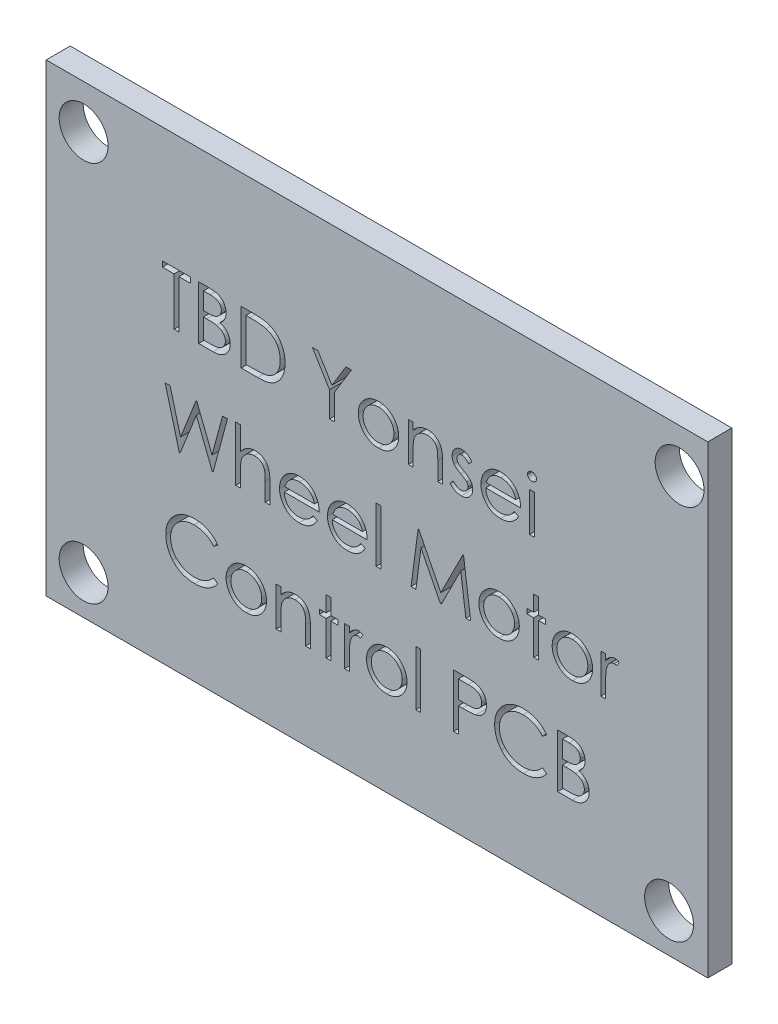
from build123d import *

# Parameters (mm, degrees)
SKETCH1_W           = 43.336
SKETCH1_H           = 30.414
SKETCH1_R           = 1.6
BOSS_EXTRUDE1_DEPTH = 1.575
SKETCH3_W           = 0.314102564
SKETCH3_H           = 2.557692307
SKETCH3_W_2         = 0.314102565
SKETCH3_H_2         = 3.58974359
CUT_EXTRUDE2_DEPTH  = 53.966979497


with BuildPart() as part:
    # Sketch1 → Boss-Extrude1 (new body)
    with BuildSketch(Plane.XY):
        with Locations((21.668, 15.207)):
            Rectangle(SKETCH1_W, SKETCH1_H)
        with Locations((2.45, 27.55)):
            Circle(SKETCH1_R, mode=Mode.SUBTRACT)
        with Locations((2.45, 2.55)):
            Circle(SKETCH1_R, mode=Mode.SUBTRACT)
        with Locations((40.8, 2.55)):
            Circle(SKETCH1_R, mode=Mode.SUBTRACT)
        with Locations((41.49, 27.55)):
            Circle(SKETCH1_R, mode=Mode.SUBTRACT)
    extrude(amount=-BOSS_EXTRUDE1_DEPTH)

    # Sketch3 → Cut-Extrude2 (cut, through all)
    # profile 1 of 30: a face of its own
    with BuildSketch(Plane.XY):
        Polygon((7.612253033, 22.462742058), (7.612253033, 22.821716417), (9.451996623, 22.821716417), (9.451996623, 22.462742058), (8.68917611, 22.462742058), (8.68917611, 19.321716417), (8.375073546, 19.321716417), (8.375073546, 22.462742058), align=None)
    # profile 2 of 30: a face of its own
    with BuildSketch(Plane.XY):
        with BuildLine():
            Line((9.990458162, 22.821716417), (10.67335079, 22.821716417))
            add(Edge.make_bspline(
                [(10.67335079, 22.821716417), (10.706779268, 22.821540666), (10.771571978, 22.821200018), (10.86579142, 22.815916887), (10.954040231, 22.808713217), (11.036344003, 22.797283125), (11.112664706, 22.783491347), (11.183232343, 22.766789531), (11.247822515, 22.746762918), (11.324935252, 22.714916636), (11.412855912, 22.667593468), (11.508054305, 22.597664903), (11.589458544, 22.51213244), (11.659644862, 22.415649784), (11.715445981, 22.309514013), (11.755815279, 22.196254824), (11.781373154, 22.077333082), (11.784001588, 21.995689904), (11.785329957, 21.954428756)],
                knots=[0, 0, 0, 0, 1.001505555, 1.941167018, 2.826882275, 3.653841531, 4.429895133, 5.150066043, 5.825578002, 6.45369114, 7.647487171, 8.808567382, 9.977351308, 11.170798116, 12.373658725, 13.556498008, 14.765093433, 16, 16, 16, 16], degree=3))
            add(Edge.make_bspline(
                [(11.785329957, 21.954428756), (11.784236738, 21.915776201), (11.782088461, 21.839820284), (11.761545701, 21.728726174), (11.729385033, 21.622974956), (11.684679784, 21.52295257), (11.626577788, 21.430918957), (11.557719469, 21.346131691), (11.474642666, 21.272180634), (11.412399426, 21.230837731), (11.380782681, 21.20983741)],
                knots=[0, 0, 0, 0, 1.044552857, 2.05264487, 3.044412934, 4.028983338, 5.005914585, 5.980388656, 6.974128949, 8, 8, 8, 8], degree=3))
            add(Edge.make_bspline(
                [(11.380782681, 21.20983741), (11.420543109, 21.194572411), (11.496614656, 21.165366687), (11.601300668, 21.113731223), (11.691495513, 21.057569112), (11.767892659, 20.996237262), (11.833230314, 20.930128452), (11.890283256, 20.858273337), (11.93896463, 20.779734579), (11.980677554, 20.695331044), (12.01322631, 20.605924576), (12.037602214, 20.5123538), (12.051569663, 20.414954244), (12.053557304, 20.348668865), (12.054560726, 20.315206)],
                knots=[0, 0, 0, 0, 1.27268992, 2.434971085, 3.483601985, 4.442670788, 5.356604649, 6.2567628, 7.179492994, 8.113709626, 9.066344395, 10.018646069, 10.999752585, 12, 12, 12, 12], degree=3))
            add(Edge.make_bspline(
                [(12.054560726, 20.315206), (12.05358388, 20.281039128), (12.051661908, 20.21381485), (12.037481936, 20.115059715), (12.013472829, 20.020684769), (11.980401683, 19.930079586), (11.937239368, 19.843419451), (11.884711404, 19.760606187), (11.82207984, 19.682471857), (11.752016971, 19.608148234), (11.672754826, 19.541320446), (11.587239071, 19.48180474), (11.494392751, 19.432858678), (11.395740757, 19.391742656), (11.290176441, 19.360335458), (11.178173833, 19.338362884), (11.059829532, 19.323557847), (10.97861978, 19.322340642), (10.936972585, 19.321716417)],
                knots=[0, 0, 0, 0, 0.978564426, 1.925352924, 2.850884081, 3.763762016, 4.682927383, 5.618979971, 6.567305752, 7.547517671, 8.540179244, 9.531824382, 10.526200242, 11.540722885, 12.589160233, 13.674978461, 14.80764778, 16, 16, 16, 16], degree=3))
            Line((10.936972585, 19.321716417), (9.990458162, 19.321716417))
            Line((9.990458162, 19.321716417), (9.990458162, 22.821716417))
        make_face()
        with BuildLine():
            Line((10.304560726, 22.462742058), (10.304560726, 21.340947186))
            Line((10.304560726, 21.340947186), (10.515598386, 21.340947186))
            add(Edge.make_bspline(
                [(10.515598386, 21.340947186), (10.546447181, 21.341347109), (10.606053341, 21.342119842), (10.692373237, 21.344333359), (10.772498255, 21.350531402), (10.846290088, 21.356727664), (10.913632532, 21.366802252), (10.974376394, 21.378794375), (11.029474991, 21.39147728), (11.093014536, 21.413046767), (11.165087485, 21.444924442), (11.241920589, 21.494396278), (11.309655059, 21.553320631), (11.366852246, 21.621311593), (11.413663717, 21.696177779), (11.446177432, 21.776724659), (11.468224716, 21.860944791), (11.470216248, 21.918763044), (11.471227392, 21.94811866)],
                knots=[0, 0, 0, 0, 1.156816544, 2.235205308, 3.236616184, 4.169592532, 5.011045266, 5.787822928, 6.49130361, 7.128639758, 8.301311294, 9.436451833, 10.541879658, 11.654887649, 12.756523258, 13.837046038, 14.901820046, 16, 16, 16, 16], degree=3))
            add(Edge.make_bspline(
                [(11.471227392, 21.94811866), (11.470701212, 21.967544432), (11.469669052, 22.005650204), (11.46121575, 22.061199558), (11.446848175, 22.11344331), (11.428393882, 22.163097421), (11.402605193, 22.208609271), (11.37224173, 22.251552467), (11.33555604, 22.290464585), (11.293798727, 22.326834084), (11.245790104, 22.359078611), (11.191558812, 22.387319375), (11.130371135, 22.410060151), (11.06325828, 22.429976304), (10.989187193, 22.443964597), (10.909012639, 22.455617985), (10.82207792, 22.461550727), (10.761932818, 22.46233609), (10.730842777, 22.462742058)],
                knots=[0, 0, 0, 0, 0.91205012, 1.789085906, 2.630437955, 3.453916878, 4.269457761, 5.079663411, 5.91843418, 6.774407191, 7.675494373, 8.627863946, 9.638891023, 10.736472738, 11.911756761, 13.175263542, 14.539845004, 16, 16, 16, 16], degree=3))
            Line((10.730842777, 22.462742058), (10.304560726, 22.462742058))
        make_face(mode=Mode.SUBTRACT)
        with BuildLine():
            Line((10.304560726, 20.981972827), (10.304560726, 19.680690776))
            Line((10.304560726, 19.680690776), (10.751876431, 19.680690776))
            add(Edge.make_bspline(
                [(10.751876431, 19.680690776), (10.783895357, 19.681074523), (10.845607615, 19.681814146), (10.934708846, 19.6842287), (11.017291949, 19.689720976), (11.092980085, 19.698366825), (11.162590538, 19.707745275), (11.225288241, 19.720356556), (11.281581434, 19.734805516), (11.346855742, 19.757139688), (11.42035925, 19.791836159), (11.499570107, 19.844150386), (11.569996325, 19.906473693), (11.629801584, 19.978604608), (11.678814572, 20.057035935), (11.714470028, 20.140181284), (11.736460884, 20.226666812), (11.739123054, 20.285633524), (11.740458162, 20.315206)],
                knots=[0, 0, 0, 0, 1.160039823, 2.235823828, 3.228722157, 4.157150951, 4.99529583, 5.772374946, 6.472645482, 7.099169577, 8.269452708, 9.405989375, 10.527446681, 11.663510218, 12.788923519, 13.866172445, 14.929861265, 16, 16, 16, 16], degree=3))
            add(Edge.make_bspline(
                [(11.740458162, 20.315206), (11.740182057, 20.33369934), (11.739634302, 20.370387722), (11.731373687, 20.424303541), (11.719359818, 20.476529415), (11.703828384, 20.527207155), (11.681208917, 20.575420532), (11.654802372, 20.622123091), (11.62384097, 20.667376571), (11.575596804, 20.724588824), (11.50542482, 20.790505837), (11.405718044, 20.855043339), (11.292345746, 20.907091146), (11.210118253, 20.929190623), (11.167641655, 20.940606641)],
                knots=[0, 0, 0, 0, 0.723448775, 1.435228256, 2.130040452, 2.821711965, 3.505591119, 4.210454504, 4.921174351, 5.648778258, 7.137944449, 8.670945889, 10.280296675, 12, 12, 12, 12], degree=3))
            add(Edge.make_bspline(
                [(11.167641655, 20.940606641), (11.150612559, 20.944061725), (11.113689967, 20.95155306), (11.053482387, 20.959460763), (10.984746518, 20.966505823), (10.907323641, 20.971716981), (10.821115799, 20.977103524), (10.725938881, 20.979198345), (10.622181566, 20.981697605), (10.550189194, 20.98187874), (10.512793899, 20.981972827)],
                knots=[0, 0, 0, 0, 0.634451884, 1.375622551, 2.216452059, 3.157844607, 4.20941857, 5.370758133, 6.634282058, 8, 8, 8, 8], degree=3))
            Line((10.512793899, 20.981972827), (10.304560726, 20.981972827))
        make_face(mode=Mode.SUBTRACT)
    # profile 3 of 30: a face of its own
    with BuildSketch(Plane.XY):
        with BuildLine():
            Line((12.772509444, 19.321716417), (12.772509444, 22.821716417))
            Line((12.772509444, 22.821716417), (13.479240213, 22.821716417))
            add(Edge.make_bspline(
                [(13.479240213, 22.821716417), (13.540709201, 22.821273847), (13.659466966, 22.820418804), (13.831079414, 22.814997413), (13.989863176, 22.805406947), (14.135296035, 22.791437421), (14.267777247, 22.774284387), (14.386935856, 22.752783983), (14.493387998, 22.727395812), (14.558857439, 22.705750362), (14.589817136, 22.695514494)],
                knots=[0, 0, 0, 0, 1.314313732, 2.53924729, 3.670748893, 4.714932338, 5.66265055, 6.526160246, 7.303039223, 8, 8, 8, 8], degree=3))
            add(Edge.make_bspline(
                [(14.589817136, 22.695514494), (14.630311875, 22.680083788), (14.710383068, 22.649572294), (14.82439019, 22.592015992), (14.931715553, 22.526802891), (15.032934698, 22.453847028), (15.125735524, 22.37108268), (15.213743421, 22.282025594), (15.293358145, 22.183437254), (15.366266441, 22.077362266), (15.4320021, 21.965050214), (15.489141258, 21.846715105), (15.536595252, 21.722957897), (15.575988478, 21.594122749), (15.607034936, 21.459926371), (15.628216867, 21.320212505), (15.642187857, 21.175533316), (15.643591909, 21.077358852), (15.644304316, 21.027545744)],
                knots=[0, 0, 0, 0, 0.984719456, 1.947108742, 2.898477687, 3.838006223, 4.779231079, 5.722358779, 6.681677486, 7.655904652, 8.64651281, 9.637519902, 10.640069247, 11.656948941, 12.698408672, 13.768548281, 14.867775369, 16, 16, 16, 16], degree=3))
            add(Edge.make_bspline(
                [(15.644304316, 21.027545744), (15.643675348, 20.984284505), (15.642435902, 20.899033716), (15.631306586, 20.773392821), (15.615130266, 20.651479249), (15.590086068, 20.533873549), (15.559683555, 20.419545331), (15.520719403, 20.309713087), (15.476083907, 20.203369278), (15.424034029, 20.101951802), (15.366892644, 20.005868429), (15.305570901, 19.915292901), (15.240134205, 19.831517679), (15.169958572, 19.754289067), (15.095950856, 19.683723489), (15.017626525, 19.619231474), (14.934783474, 19.562074919), (14.847792752, 19.510007811), (14.754116622, 19.464587455), (14.651980756, 19.426157445), (14.540949578, 19.39431083), (14.421295621, 19.367739934), (14.292812144, 19.346662631), (14.155373178, 19.332536239), (14.009189888, 19.322983306), (13.908810623, 19.322146913), (13.85714486, 19.321716417)],
                knots=[0, 0, 0, 0, 1.105936401, 2.179363191, 3.223086493, 4.248585256, 5.251745608, 6.245858792, 7.225916811, 8.198733463, 9.158002045, 10.082870192, 10.993790845, 11.873723703, 12.748670949, 13.606408763, 14.465103618, 15.319838547, 16.196477973, 17.123216899, 18.106603292, 19.147568657, 20.255746949, 21.433717677, 22.679120308, 24, 24, 24, 24], degree=3))
            Line((13.85714486, 19.321716417), (12.772509444, 19.321716417))
        make_face()
        with BuildLine():
            Line((13.086612008, 19.680690776), (13.488354796, 19.680690776))
            add(Edge.make_bspline(
                [(13.488354796, 19.680690776), (13.546083167, 19.680938872), (13.657115965, 19.681416052), (13.816773963, 19.685603255), (13.962653359, 19.692445193), (14.094774869, 19.702020271), (14.213063893, 19.714688886), (14.317767643, 19.728813789), (14.408542901, 19.746411239), (14.463472338, 19.762362199), (14.488855598, 19.769733244)],
                knots=[0, 0, 0, 0, 1.375205317, 2.645023457, 3.804390687, 4.853969522, 5.800190428, 6.637939096, 7.370582563, 8, 8, 8, 8], degree=3))
            add(Edge.make_bspline(
                [(14.488855598, 19.769733244), (14.52080396, 19.780984802), (14.583937598, 19.803219175), (14.674818683, 19.843776836), (14.759575688, 19.891818906), (14.839685713, 19.94522118), (14.914012368, 20.005867182), (14.983436485, 20.072438171), (15.047818286, 20.145272946), (15.106492594, 20.224281107), (15.159000898, 20.308970903), (15.204472128, 20.398509737), (15.244323659, 20.491916547), (15.275602252, 20.590625706), (15.300117836, 20.693754764), (15.317482524, 20.801310977), (15.328297248, 20.913274259), (15.329558696, 20.989426383), (15.330201751, 21.028246865)],
                knots=[0, 0, 0, 0, 0.998632004, 1.973411704, 2.929992603, 3.868527914, 4.809262121, 5.754881198, 6.702106254, 7.672490631, 8.653608572, 9.636854334, 10.631411391, 11.644891563, 12.686317036, 13.754757253, 14.855430412, 16, 16, 16, 16], degree=3))
            add(Edge.make_bspline(
                [(15.330201751, 21.028246865), (15.329688464, 21.069180346), (15.328680106, 21.14959453), (15.316005796, 21.267585225), (15.297484241, 21.381065876), (15.270700555, 21.490044071), (15.236569676, 21.594732423), (15.193975034, 21.694551934), (15.145308415, 21.790556802), (15.087405078, 21.880531168), (15.023989484, 21.965624277), (14.953611605, 22.043579193), (14.877389567, 22.114573493), (14.796154717, 22.179712806), (14.707617618, 22.236376482), (14.613863927, 22.287063163), (14.513518256, 22.330079054), (14.44370556, 22.352957917), (14.408226591, 22.364585006)],
                knots=[0, 0, 0, 0, 1.122418816, 2.205001699, 3.251619955, 4.274784885, 5.280384055, 6.268708349, 7.249350384, 8.229342522, 9.199999885, 10.157847722, 11.105861043, 12.055065948, 13.010012805, 13.98527497, 14.976112212, 16, 16, 16, 16], degree=3))
            add(Edge.make_bspline(
                [(14.408226591, 22.364585006), (14.378875445, 22.372701434), (14.316466855, 22.389959187), (14.21462739, 22.408784559), (14.100012241, 22.425389058), (13.97211254, 22.439447098), (13.831074081, 22.449534419), (13.676788393, 22.457105734), (13.509188788, 22.462212366), (13.393006254, 22.462561073), (13.332705758, 22.462742058)],
                knots=[0, 0, 0, 0, 0.674548936, 1.434276114, 2.292660221, 3.240891867, 4.284742987, 5.42552168, 6.663806718, 8, 8, 8, 8], degree=3))
            Line((13.332705758, 22.462742058), (13.086612008, 22.462742058))
            Line((13.086612008, 22.462742058), (13.086612008, 19.680690776))
        make_face(mode=Mode.SUBTRACT)
    # profile 4 of 30: a face of its own
    with BuildSketch(Plane.XY):
        Polygon((17.43917611, 22.821716417), (17.798851591, 22.821716417), (18.718723386, 21.317810167), (19.637192937, 22.821716417), (19.996868418, 22.821716417), (18.875073546, 20.985478436), (18.875073546, 19.321716417), (18.560970982, 19.321716417), (18.560970982, 20.985478436), align=None)
    # profile 5 of 30: a face of its own
    with BuildSketch(Plane.XY):
        with BuildLine():
            add(Edge.make_bspline(
                [(21.770706559, 21.924280519), (21.818697832, 21.923258628), (21.91279699, 21.921254949), (22.050604875, 21.899839984), (22.182150011, 21.867092619), (22.307936204, 21.821821057), (22.426352499, 21.761139107), (22.539123743, 21.688729815), (22.645940752, 21.602947222), (22.709963781, 21.536589154), (22.742461367, 21.50290632)],
                knots=[0, 0, 0, 0, 1.054011418, 2.066658804, 3.057071809, 4.030435133, 4.997543892, 5.974964718, 6.972108034, 8, 8, 8, 8], degree=3))
            add(Edge.make_bspline(
                [(22.742461367, 21.50290632), (22.770443321, 21.470692335), (22.825865701, 21.406887792), (22.89693142, 21.30343218), (22.95815298, 21.196292079), (23.007215941, 21.084044752), (23.045900965, 20.967670081), (23.073366661, 20.84676807), (23.089703596, 20.721605723), (23.091906563, 20.636601885), (23.093022264, 20.593551353)],
                knots=[0, 0, 0, 0, 1.025258237, 2.030674902, 3.01204498, 3.988269485, 4.97094183, 5.956517959, 6.965070386, 8, 8, 8, 8], degree=3))
            add(Edge.make_bspline(
                [(23.093022264, 20.593551353), (23.092040927, 20.550251295), (23.090101759, 20.464688362), (23.071758142, 20.338668996), (23.043227056, 20.216474173), (23.002395218, 20.098615479), (22.950037109, 19.984732652), (22.886146421, 19.875323103), (22.810274804, 19.770170969), (22.724270807, 19.670169131), (22.629218931, 19.578002916), (22.526102783, 19.497674647), (22.416948749, 19.428853122), (22.300305396, 19.373416707), (22.177237909, 19.329707006), (22.047480841, 19.29900699), (21.911235771, 19.280445306), (21.818208549, 19.278061733), (21.770706559, 19.276844622)],
                knots=[0, 0, 0, 0, 0.998656419, 1.973391657, 2.932242238, 3.890759089, 4.846373663, 5.82037756, 6.809684879, 7.83454468, 8.860553229, 9.859544525, 10.845671541, 11.83227036, 12.833544569, 13.85385346, 14.904124723, 16, 16, 16, 16], degree=3))
            add(Edge.make_bspline(
                [(21.770706559, 19.276844622), (21.72297184, 19.278065818), (21.62948098, 19.280457592), (21.492754998, 19.298934875), (21.362765379, 19.329692858), (21.239536781, 19.37356035), (21.122391934, 19.428854894), (21.012605437, 19.497466584), (20.909405521, 19.578026739), (20.814333537, 19.670162676), (20.728334931, 19.770172632), (20.652461923, 19.875322671), (20.588571597, 19.984732764), (20.536213393, 20.098615449), (20.49538158, 20.216474181), (20.466850487, 20.338668994), (20.448506873, 20.464688362), (20.446567704, 20.550251295), (20.445586367, 20.593551353)],
                knots=[0, 0, 0, 0, 1.099876186, 2.154163076, 3.173186993, 4.173200201, 5.163417411, 6.152872554, 7.150605724, 8.17532212, 9.198891216, 10.186952605, 11.159729845, 12.11414092, 13.071450619, 14.029093627, 15.002601286, 16, 16, 16, 16], degree=3))
            add(Edge.make_bspline(
                [(20.445586367, 20.593551353), (20.446709677, 20.636367898), (20.448933639, 20.721137301), (20.465254148, 20.846064361), (20.492612704, 20.966761751), (20.531344101, 21.082687227), (20.580859292, 21.194442663), (20.641220579, 21.301847494), (20.713011212, 21.404835294), (20.768213164, 21.468557374), (20.796147264, 21.500802955)],
                knots=[0, 0, 0, 0, 1.031353054, 2.041901799, 3.029428768, 4.008703097, 4.981709435, 5.96992636, 6.972712378, 8, 8, 8, 8], degree=3))
            add(Edge.make_bspline(
                [(20.796147264, 21.500802955), (20.828595855, 21.534777894), (20.892411719, 21.601595591), (20.999760447, 21.687128115), (21.112254268, 21.761044189), (21.231979194, 21.820520404), (21.357662052, 21.867358922), (21.489881295, 21.899924437), (21.62815681, 21.921177792), (21.722716431, 21.92323597), (21.770706559, 21.924280519)],
                knots=[0, 0, 0, 0, 1.027980169, 2.021703884, 2.998553061, 3.971491411, 4.943284454, 5.930300938, 6.949603206, 8, 8, 8, 8], degree=3))
        make_face()
        with BuildLine():
            add(Edge.make_bspline(
                [(21.769304316, 21.610177955), (21.735366704, 21.609213363), (21.668367576, 21.607309081), (21.569747991, 21.592825176), (21.474807837, 21.569877672), (21.383366993, 21.537273616), (21.29573382, 21.495174717), (21.211824418, 21.443466357), (21.131391978, 21.3828334), (21.056009915, 21.313370729), (20.986827603, 21.237491734), (20.926349626, 21.156643375), (20.87492452, 21.072137029), (20.832084361, 20.983884818), (20.800177173, 20.890992404), (20.77700415, 20.794511773), (20.76253391, 20.694246356), (20.760647531, 20.626085338), (20.759688931, 20.591447987)],
                knots=[0, 0, 0, 0, 1.021534396, 2.016698045, 2.994645724, 3.958388632, 4.93408049, 5.916473867, 6.921342795, 7.962252576, 8.998418191, 10.008913653, 10.997312074, 11.973003931, 12.956656626, 13.948281152, 14.957379055, 16, 16, 16, 16], degree=3))
            add(Edge.make_bspline(
                [(20.759688931, 20.591447987), (20.761295755, 20.54669596), (20.764484999, 20.457871554), (20.790420235, 20.327060432), (20.833806515, 20.20147858), (20.892393795, 20.081862194), (20.965800014, 19.971189916), (21.05228708, 19.872518431), (21.150926781, 19.78733262), (21.260543281, 19.716651774), (21.378897599, 19.660492019), (21.50415392, 19.620693043), (21.634794614, 19.59482135), (21.724075345, 19.592249876), (21.769304316, 19.590947186)],
                knots=[0, 0, 0, 0, 1.016792936, 2.018143844, 3.017858371, 4.030088057, 5.03801393, 6.028138512, 7.003788237, 7.991172063, 8.984598303, 9.972568034, 10.972917682, 12, 12, 12, 12], degree=3))
            add(Edge.make_bspline(
                [(21.769304316, 19.590947186), (21.814530684, 19.592257466), (21.90380628, 19.594843923), (22.034265457, 19.620562743), (22.159179429, 19.660666403), (22.277410817, 19.716588613), (22.38697742, 19.787601028), (22.486326541, 19.872037405), (22.572075153, 19.971451256), (22.645408757, 20.082008785), (22.7049555, 20.201293137), (22.748138702, 20.32708361), (22.774136288, 20.457865652), (22.777317117, 20.546693982), (22.7789197, 20.591447987)],
                knots=[0, 0, 0, 0, 1.02726834, 2.027799167, 3.010890988, 4.004497153, 4.992059811, 5.971914811, 6.958719428, 7.966827853, 8.981595046, 9.981490638, 10.983022906, 12, 12, 12, 12], degree=3))
            add(Edge.make_bspline(
                [(22.7789197, 20.591447987), (22.77796143, 20.626085545), (22.776075701, 20.694246971), (22.761600737, 20.794509424), (22.738445197, 20.891001021), (22.70647358, 20.983853024), (22.663819566, 21.072365528), (22.611402773, 21.156395255), (22.551171747, 21.237771801), (22.481154626, 21.313125442), (22.405851249, 21.382860479), (22.32538621, 21.443489868), (22.241601232, 21.494947464), (22.154222649, 21.537633704), (22.062770082, 21.569581045), (21.967962952, 21.592957676), (21.869764142, 21.607247873), (21.803005099, 21.609195014), (21.769304316, 21.610177955)],
                knots=[0, 0, 0, 0, 1.042956736, 2.052379634, 3.044323526, 4.02829302, 5.004299113, 5.996692471, 7.007513377, 8.048758398, 9.090003419, 10.095195979, 11.07790575, 12.047570684, 13.018257071, 13.989683339, 14.985167495, 16, 16, 16, 16], degree=3))
        make_face(mode=Mode.SUBTRACT)
    # profile 6 of 30: a face of its own
    with BuildSketch(Plane.XY):
        with BuildLine():
            Line((23.721227392, 21.879408724), (24.035329957, 21.879408724))
            Line((24.035329957, 21.879408724), (24.035329957, 21.418070583))
            add(Edge.make_bspline(
                [(24.035329957, 21.418070583), (24.068867592, 21.459913306), (24.133948543, 21.54111057), (24.242332876, 21.647831144), (24.356876776, 21.735776369), (24.47687878, 21.805880163), (24.60250179, 21.858726789), (24.73298006, 21.89689272), (24.869094766, 21.919777549), (24.961659203, 21.922767779), (25.008487008, 21.924280519)],
                knots=[0, 0, 0, 0, 1.12780773, 2.188550248, 3.19190651, 4.159438251, 5.104880172, 6.052711206, 7.014878035, 8, 8, 8, 8], degree=3))
            add(Edge.make_bspline(
                [(25.008487008, 21.924280519), (25.055817642, 21.922535324), (25.14845511, 21.919119555), (25.283333171, 21.892102864), (25.409306565, 21.845957609), (25.525926121, 21.782745539), (25.631053334, 21.704139065), (25.723378185, 21.612561284), (25.799741433, 21.5072252), (25.850938796, 21.409502044), (25.884664443, 21.32281325), (25.905896781, 21.2485665), (25.923927762, 21.165848348), (25.93955951, 21.074908759), (25.950136622, 20.975110569), (25.958478914, 20.866862877), (25.964457608, 20.750200747), (25.964694815, 20.669514119), (25.964817136, 20.62790632)],
                knots=[0, 0, 0, 0, 1.235846778, 2.418850247, 3.575807741, 4.728682307, 5.871620074, 6.994088408, 8.11269785, 9.256955736, 9.865816715, 10.540099792, 11.271859618, 12.076849838, 12.949306005, 13.892391288, 14.913166135, 16, 16, 16, 16], degree=3))
            Line((25.964817136, 20.62790632), (25.964817136, 19.321716417))
            Line((25.964817136, 19.321716417), (25.650714572, 19.321716417))
            Line((25.650714572, 19.321716417), (25.650714572, 20.524841417))
            add(Edge.make_bspline(
                [(25.650714572, 20.524841417), (25.650521364, 20.559663862), (25.65015179, 20.626273272), (25.648986143, 20.721642296), (25.646176337, 20.808128874), (25.642228024, 20.885526241), (25.636448993, 20.953760078), (25.630426362, 21.012969355), (25.623061385, 21.063078897), (25.616498472, 21.093243979), (25.613555117, 21.106772506)],
                knots=[0, 0, 0, 0, 1.430800155, 2.736877192, 3.918605307, 4.986035426, 5.920637409, 6.731861385, 7.431261377, 8, 8, 8, 8], degree=3))
            add(Edge.make_bspline(
                [(25.613555117, 21.106772506), (25.602929585, 21.146483691), (25.582478725, 21.222915436), (25.531944741, 21.326589789), (25.468130561, 21.414787976), (25.390232711, 21.486964698), (25.299003636, 21.543135535), (25.194696493, 21.582109489), (25.078317852, 21.606485759), (24.99646347, 21.608912891), (24.953799508, 21.610177955)],
                knots=[0, 0, 0, 0, 1.084156227, 2.086665306, 3.027808233, 3.945421172, 4.874247719, 5.839848303, 6.874090471, 8, 8, 8, 8], degree=3))
            add(Edge.make_bspline(
                [(24.953799508, 21.610177955), (24.928531824, 21.60970195), (24.878527731, 21.608759949), (24.804377759, 21.599308651), (24.732453586, 21.583850196), (24.662033377, 21.562981558), (24.594525583, 21.534319289), (24.527761292, 21.501789919), (24.464254528, 21.461241707), (24.402651131, 21.416051085), (24.345338323, 21.365971878), (24.292009985, 21.313127368), (24.244471965, 21.256851764), (24.201403289, 21.198051817), (24.164225026, 21.135919979), (24.131771938, 21.071055672), (24.104236243, 21.003373524), (24.090553551, 20.956398462), (24.08370736, 20.932894301)],
                knots=[0, 0, 0, 0, 1.023777757, 2.026029729, 3.023749952, 4.003683103, 4.997618607, 5.993177895, 7.010360494, 8.046726602, 9.087585522, 10.09234134, 11.086953743, 12.070360549, 13.043493632, 14.017870808, 15.008233677, 16, 16, 16, 16], degree=3))
            add(Edge.make_bspline(
                [(24.08370736, 20.932894301), (24.079767712, 20.915639098), (24.071191303, 20.878075424), (24.061928123, 20.816431004), (24.053520548, 20.745121029), (24.046483589, 20.664228712), (24.042178173, 20.573470837), (24.037483776, 20.473234999), (24.035774715, 20.363121511), (24.035482361, 20.286459818), (24.035329957, 20.246496064)],
                knots=[0, 0, 0, 0, 0.615963638, 1.340920617, 2.168419149, 3.115676021, 4.16674242, 5.331190069, 6.6087489, 8, 8, 8, 8], degree=3))
            Line((24.035329957, 20.246496064), (24.035329957, 19.321716417))
            Line((24.035329957, 19.321716417), (23.721227392, 19.321716417))
            Line((23.721227392, 19.321716417), (23.721227392, 21.879408724))
        make_face()
    # profile 7 of 30: a face of its own
    with BuildSketch(Plane.XY):
        with BuildLine():
            Line((27.894304316, 21.560398308), (27.68116329, 21.340947186))
            add(Edge.make_bspline(
                [(27.68116329, 21.340947186), (27.662772786, 21.362260332), (27.627318061, 21.403349569), (27.57108658, 21.458286636), (27.515062976, 21.504423575), (27.460014162, 21.543375834), (27.404555893, 21.57282498), (27.349338975, 21.594319842), (27.294306237, 21.607621648), (27.257520201, 21.609336087), (27.239456559, 21.610177955)],
                knots=[0, 0, 0, 0, 1.26578478, 2.440284043, 3.530471711, 4.527705817, 5.468200915, 6.346673037, 7.188140097, 8, 8, 8, 8], degree=3))
            add(Edge.make_bspline(
                [(27.239456559, 21.610177955), (27.217317169, 21.609103082), (27.173749983, 21.606987884), (27.111324165, 21.585874454), (27.05337354, 21.553465715), (27.00321656, 21.507497132), (26.96072888, 21.454732863), (26.929715199, 21.395736538), (26.910749215, 21.332288494), (26.908344483, 21.288258637), (26.907124828, 21.265927154)],
                knots=[0, 0, 0, 0, 0.99966794, 1.967205029, 2.953328237, 3.988086729, 5.028030931, 6.008226631, 6.989793394, 8, 8, 8, 8], degree=3))
            add(Edge.make_bspline(
                [(26.907124828, 21.265927154), (26.908235641, 21.24571511), (26.910454134, 21.205347999), (26.927700813, 21.145799965), (26.955166885, 21.087742927), (26.980837079, 21.05218002), (26.994063931, 21.03385584)],
                knots=[0, 0, 0, 0, 0.960159726, 1.917612774, 2.927026955, 4, 4, 4, 4], degree=3))
            add(Edge.make_bspline(
                [(26.994063931, 21.03385584), (27.002027425, 21.024071255), (27.018976717, 21.003246001), (27.050785232, 20.974342147), (27.086807735, 20.942399896), (27.130127673, 20.910463059), (27.178878701, 20.876831334), (27.234117985, 20.842829201), (27.29409249, 20.805864776), (27.337029797, 20.782420341), (27.359348386, 20.770234045)],
                knots=[0, 0, 0, 0, 0.66740084, 1.420478572, 2.27185888, 3.217733974, 4.268547843, 5.408967954, 6.65319498, 8, 8, 8, 8], degree=3))
            add(Edge.make_bspline(
                [(27.359348386, 20.770234045), (27.386561963, 20.754989142), (27.439129633, 20.72554101), (27.5138224, 20.679831306), (27.581609441, 20.634399882), (27.643065109, 20.589732608), (27.697006918, 20.54457974), (27.745071471, 20.500671983), (27.786059914, 20.456682675), (27.809013841, 20.425949561), (27.819985405, 20.411259686)],
                knots=[0, 0, 0, 0, 1.27191281, 2.456916733, 3.569705269, 4.599008579, 5.553216877, 6.436649441, 7.252746552, 8, 8, 8, 8], degree=3))
            add(Edge.make_bspline(
                [(27.819985405, 20.411259686), (27.838195933, 20.381593598), (27.874438262, 20.322552577), (27.912496528, 20.225334149), (27.934556803, 20.122223647), (27.937619024, 20.051691427), (27.93917611, 20.015826994)],
                knots=[0, 0, 0, 0, 0.995354457, 1.980940102, 2.973342416, 4, 4, 4, 4], degree=3))
            add(Edge.make_bspline(
                [(27.93917611, 20.015826994), (27.938456577, 19.990557847), (27.937038657, 19.940762234), (27.92718059, 19.867427404), (27.910225613, 19.797292847), (27.887131859, 19.729597562), (27.855947486, 19.665638623), (27.819399689, 19.603802374), (27.775524778, 19.545426443), (27.725433402, 19.490587483), (27.670587908, 19.440501735), (27.61208177, 19.396477781), (27.549842939, 19.359903444), (27.484316138, 19.329638099), (27.415352484, 19.305569841), (27.342941194, 19.28890731), (27.26731244, 19.278934549), (27.215882632, 19.277550072), (27.189676912, 19.276844622)],
                knots=[0, 0, 0, 0, 1.032770009, 2.035186124, 3.017557409, 3.978232242, 4.952395191, 5.920591857, 6.910227898, 7.931268572, 8.952309245, 9.941945286, 10.918353717, 11.897095711, 12.887975737, 13.898235213, 14.929059601, 16, 16, 16, 16], degree=3))
            add(Edge.make_bspline(
                [(27.189676912, 19.276844622), (27.154309736, 19.277837322), (27.084066809, 19.279808929), (26.98017709, 19.29831499), (26.878656331, 19.327110384), (26.780272791, 19.366826319), (26.687226677, 19.416977031), (26.602095753, 19.477039425), (26.52458429, 19.545029422), (26.480466016, 19.597142333), (26.45840688, 19.623198788)],
                knots=[0, 0, 0, 0, 1.013940152, 2.01379169, 3.017749504, 4.037548394, 5.051665909, 6.043208538, 7.021604269, 8, 8, 8, 8], degree=3))
            Line((26.45840688, 19.623198788), (26.666640053, 19.860177955))
            add(Edge.make_bspline(
                [(26.666640053, 19.860177955), (26.686412466, 19.838823191), (26.724744278, 19.797423751), (26.786045495, 19.74229941), (26.848424896, 19.696098139), (26.911259582, 19.657454724), (26.975479677, 19.627679321), (27.040725291, 19.606760727), (27.106863715, 19.593316535), (27.151285851, 19.591738252), (27.17355111, 19.590947186)],
                knots=[0, 0, 0, 0, 1.179806542, 2.287233372, 3.337373186, 4.324005949, 5.273901747, 6.200048787, 7.097828587, 8, 8, 8, 8], degree=3))
            add(Edge.make_bspline(
                [(27.17355111, 19.590947186), (27.203869036, 19.592318011), (27.263105178, 19.594996373), (27.347948937, 19.619313465), (27.426287563, 19.657443416), (27.494310909, 19.711528115), (27.55221307, 19.774483687), (27.594141244, 19.845397806), (27.620417419, 19.922189263), (27.623503418, 19.975421566), (27.625073546, 20.002505679)],
                knots=[0, 0, 0, 0, 1.072336372, 2.095165389, 3.102688358, 4.141489647, 5.156069229, 6.117746104, 7.042326257, 8, 8, 8, 8], degree=3))
            add(Edge.make_bspline(
                [(27.625073546, 20.002505679), (27.623987252, 20.024815298), (27.621842509, 20.068862654), (27.604999237, 20.132612995), (27.578386385, 20.193082275), (27.552181737, 20.228471923), (27.538835566, 20.246496064)],
                knots=[0, 0, 0, 0, 1.013901739, 2.00181326, 2.98231254, 4, 4, 4, 4], degree=3))
            add(Edge.make_bspline(
                [(27.538835566, 20.246496064), (27.530813171, 20.255531426), (27.513337499, 20.275213708), (27.481282257, 20.303638787), (27.442900395, 20.334276886), (27.397760232, 20.366608475), (27.34577077, 20.40020708), (27.286721295, 20.434896433), (27.221420742, 20.472324159), (27.175250111, 20.497143814), (27.151115213, 20.510117859)],
                knots=[0, 0, 0, 0, 0.615000592, 1.339693406, 2.178160186, 3.116406724, 4.166410947, 5.330106347, 6.604359322, 8, 8, 8, 8], degree=3))
            add(Edge.make_bspline(
                [(27.151115213, 20.510117859), (27.125068573, 20.524656991), (27.074555825, 20.552853007), (27.003008534, 20.596769087), (26.93846118, 20.641436362), (26.879360606, 20.684349201), (26.8271996, 20.727770145), (26.782183652, 20.771747396), (26.742540436, 20.814507383), (26.720593024, 20.844804679), (26.710109604, 20.859276513)],
                knots=[0, 0, 0, 0, 1.262093308, 2.447601706, 3.550203992, 4.582594899, 5.537233252, 6.418365656, 7.244515135, 8, 8, 8, 8], degree=3))
            add(Edge.make_bspline(
                [(26.710109604, 20.859276513), (26.691979004, 20.888422128), (26.655711469, 20.946723543), (26.620496278, 21.04403402), (26.596290249, 21.146479077), (26.594127859, 21.217165931), (26.593022264, 21.253306961)],
                knots=[0, 0, 0, 0, 0.985009483, 1.970363186, 2.962279964, 4, 4, 4, 4], degree=3))
            add(Edge.make_bspline(
                [(26.593022264, 21.253306961), (26.59355646, 21.276932359), (26.594601955, 21.32317061), (26.602946007, 21.391109431), (26.618137718, 21.455657585), (26.637192641, 21.517784448), (26.663675645, 21.576286542), (26.69532155, 21.631944013), (26.732508975, 21.684679931), (26.775352266, 21.733683063), (26.822458911, 21.778192389), (26.873353681, 21.816991017), (26.926891938, 21.850097372), (26.983300357, 21.877862532), (27.04312083, 21.898863915), (27.105935217, 21.9133213), (27.171616372, 21.922976503), (27.216517497, 21.923839587), (27.239456559, 21.924280519)],
                knots=[0, 0, 0, 0, 1.087655834, 2.128696564, 3.144119009, 4.137814668, 5.115653402, 6.093965665, 7.082169637, 8.081268856, 9.086088321, 10.061021666, 11.022561449, 11.980240094, 12.950172527, 13.934149372, 14.944599409, 16, 16, 16, 16], degree=3))
            add(Edge.make_bspline(
                [(27.239456559, 21.924280519), (27.266648623, 21.923176178), (27.321542844, 21.920946781), (27.40389747, 21.90324109), (27.486130813, 21.874107986), (27.568454162, 21.833871753), (27.650264452, 21.781804877), (27.732281309, 21.718875578), (27.815489339, 21.645497863), (27.867445652, 21.589398638), (27.894304316, 21.560398308)],
                knots=[0, 0, 0, 0, 0.845714091, 1.707292901, 2.609013841, 3.555613372, 4.552488639, 5.621697636, 6.770543573, 8, 8, 8, 8], degree=3))
        make_face()
    # profile 8 of 30: a face of its own
    with BuildSketch(Plane.XY):
        with BuildLine():
            Line((30.666539892, 20.129408724), (30.945586367, 19.982874269))
            add(Edge.make_bspline(
                [(30.945586367, 19.982874269), (30.923349772, 19.943430938), (30.880086163, 19.866689835), (30.805685415, 19.761257975), (30.727693343, 19.666410259), (30.642589375, 19.584680605), (30.552919696, 19.51342922), (30.458187041, 19.451091395), (30.357898223, 19.397972874), (30.252048498, 19.353220347), (30.139748947, 19.318810852), (30.020727431, 19.294506632), (29.894755935, 19.279483363), (29.808409756, 19.277738222), (29.764196142, 19.276844622)],
                knots=[0, 0, 0, 0, 1.120438281, 2.179929193, 3.190490725, 4.156257408, 5.095198341, 6.022838206, 6.959905092, 7.901321166, 8.864066838, 9.862729781, 10.905609505, 12, 12, 12, 12], degree=3))
            add(Edge.make_bspline(
                [(29.764196142, 19.276844622), (29.715054165, 19.277991797), (29.619192403, 19.280229604), (29.479652656, 19.299522068), (29.348273238, 19.330994427), (29.225061534, 19.374959968), (29.110319282, 19.432387293), (29.003818427, 19.502346774), (28.904998901, 19.584479029), (28.816974692, 19.679495473), (28.737730809, 19.78117743), (28.667804989, 19.887133314), (28.609347558, 19.997096539), (28.561794948, 20.110367063), (28.523390083, 20.226230956), (28.496623379, 20.345742424), (28.481193631, 20.468578008), (28.478829186, 20.551675344), (28.477637649, 20.593551353)],
                knots=[0, 0, 0, 0, 1.145258523, 2.234067595, 3.276747158, 4.290159414, 5.277019952, 6.260822364, 7.254936242, 8.264827045, 9.274100331, 10.257902744, 11.220704747, 12.172965371, 13.118907548, 14.062713208, 15.023725156, 16, 16, 16, 16], degree=3))
            add(Edge.make_bspline(
                [(28.477637649, 20.593551353), (28.47869679, 20.632846183), (28.480795868, 20.710723348), (28.494026656, 20.825988892), (28.517474949, 20.938017345), (28.549651273, 21.046901793), (28.591202519, 21.152459927), (28.642034738, 21.25475599), (28.702227116, 21.35368113), (28.74869979, 21.416084264), (28.772108803, 21.447517699)],
                knots=[0, 0, 0, 0, 1.024358464, 2.0301432, 3.019427413, 4.004406732, 4.986367066, 5.972626655, 6.978780325, 8, 8, 8, 8], degree=3))
            add(Edge.make_bspline(
                [(28.772108803, 21.447517699), (28.803816485, 21.485386569), (28.866227432, 21.559924719), (28.971783787, 21.657863045), (29.086083984, 21.73990682), (29.20769561, 21.807913956), (29.338032084, 21.859587603), (29.475341375, 21.898095186), (29.621186961, 21.919673197), (29.720892182, 21.92272103), (29.771908482, 21.924280519)],
                knots=[0, 0, 0, 0, 1.030682036, 2.02871468, 2.997146059, 3.962720338, 4.930598197, 5.918074684, 6.934738563, 8, 8, 8, 8], degree=3))
            add(Edge.make_bspline(
                [(29.771908482, 21.924280519), (29.824356087, 21.92292647), (29.927246333, 21.920270135), (30.077278454, 21.895643802), (30.219239171, 21.856591247), (30.353071675, 21.801437457), (30.478789536, 21.730277905), (30.595575586, 21.642136063), (30.705427098, 21.539717976), (30.769335677, 21.460954767), (30.801856399, 21.42087507)],
                knots=[0, 0, 0, 0, 1.056321875, 2.072262726, 3.055038591, 4.01806755, 4.982017516, 5.957941055, 6.960871419, 8, 8, 8, 8], degree=3))
            add(Edge.make_bspline(
                [(30.801856399, 21.42087507), (30.823983337, 21.390671489), (30.86808993, 21.33046537), (30.92333703, 21.232294213), (30.971294425, 21.129583619), (31.009627386, 21.020673322), (31.040666887, 20.906853742), (31.063123706, 20.787311197), (31.076293325, 20.662081286), (31.078882022, 20.57675473), (31.080201751, 20.533254878)],
                knots=[0, 0, 0, 0, 0.94817472, 1.890038105, 2.849395472, 3.817997239, 4.812318967, 5.836947057, 6.897266129, 8, 8, 8, 8], degree=3))
            Line((31.080201751, 20.533254878), (28.791740213, 20.533254878))
            add(Edge.make_bspline(
                [(28.791740213, 20.533254878), (28.793279819, 20.499554414), (28.796307393, 20.43328381), (28.810422537, 20.336313027), (28.83267131, 20.243939685), (28.863940373, 20.156856643), (28.901807218, 20.073926515), (28.948192935, 19.995764478), (29.003532489, 19.922726548), (29.065258188, 19.854159411), (29.133965284, 19.79309865), (29.206248031, 19.738446873), (29.283141596, 19.692641277), (29.364039679, 19.655461387), (29.448811464, 19.626355071), (29.53748366, 19.60648725), (29.629881776, 19.593180143), (29.69286751, 19.591700478), (29.724933322, 19.590947186)],
                knots=[0, 0, 0, 0, 1.094153842, 2.151609401, 3.174256925, 4.172055639, 5.149267565, 6.128595816, 7.11444997, 8.118368179, 9.117203808, 10.09244225, 11.054858984, 12.015122123, 12.976791628, 13.957293641, 14.960065497, 16, 16, 16, 16], degree=3))
            add(Edge.make_bspline(
                [(29.724933322, 19.590947186), (29.75628447, 19.591555243), (29.81849116, 19.592761744), (29.911132018, 19.604493654), (30.002271545, 19.62346393), (30.091532528, 19.64935392), (30.177103374, 19.680930772), (30.256348924, 19.71903363), (30.32922914, 19.761183377), (30.397346107, 19.809393052), (30.4634171, 19.868401239), (30.528959586, 19.94203696), (30.59923624, 20.029124488), (30.643225833, 20.094670153), (30.666539892, 20.129408724)],
                knots=[0, 0, 0, 0, 0.99110716, 1.966546729, 2.947904876, 3.932708344, 4.903319531, 5.828989031, 6.710028674, 7.56322171, 8.463672341, 9.504779593, 10.677557249, 12, 12, 12, 12], degree=3))
        make_face()
        with BuildLine():
            add(Edge.make_bspline(
                [(30.766099187, 20.847357442), (30.754602563, 20.889020316), (30.732475261, 20.969207937), (30.686238897, 21.080248827), (30.634167356, 21.178936728), (30.572545625, 21.264516361), (30.502726899, 21.340519874), (30.422081716, 21.406938459), (30.331645823, 21.46635591), (30.231886682, 21.51650841), (30.126244897, 21.559198268), (30.015638705, 21.587823384), (29.902780917, 21.607432927), (29.826446631, 21.609259035), (29.788034283, 21.610177955)],
                knots=[0, 0, 0, 0, 1.154881502, 2.222775134, 3.210006277, 4.132804581, 5.035138423, 5.962687519, 6.919655026, 7.923214229, 8.944639381, 9.960483929, 10.97369054, 12, 12, 12, 12], degree=3))
            add(Edge.make_bspline(
                [(29.788034283, 21.610177955), (29.756684845, 21.609566284), (29.694713596, 21.608357137), (29.603412528, 21.596887008), (29.515732829, 21.577927163), (29.431027541, 21.551962207), (29.350406673, 21.517353604), (29.272211905, 21.476770378), (29.198431508, 21.427228794), (29.152290213, 21.389469939), (29.128979796, 21.370394301)],
                knots=[0, 0, 0, 0, 1.04873581, 2.073130211, 3.073294108, 4.04793562, 5.032784715, 6.005352987, 6.992311501, 8, 8, 8, 8], degree=3))
            add(Edge.make_bspline(
                [(29.128979796, 21.370394301), (29.112286514, 21.355299986), (29.07850338, 21.32475277), (29.033362859, 21.272123563), (28.990142386, 21.215372001), (28.950808733, 21.152326876), (28.914731147, 21.083706097), (28.88097117, 21.010088462), (28.850584757, 20.930915332), (28.833488647, 20.875742893), (28.824692937, 20.847357442)],
                knots=[0, 0, 0, 0, 0.879870761, 1.780643979, 2.707998968, 3.669668524, 4.684282772, 5.740141944, 6.837334558, 8, 8, 8, 8], degree=3))
            Line((28.824692937, 20.847357442), (30.766099187, 20.847357442))
        make_face(mode=Mode.SUBTRACT)
    # profile 9 of 30: a face of its own
    with BuildSketch(Plane.XY):
        with BuildLine():
            add(Edge.make_bspline(
                [(31.819184123, 22.956331801), (31.838675439, 22.955427649), (31.876843179, 22.953657145), (31.932036447, 22.938495668), (31.982293459, 22.912795982), (32.026871191, 22.878316301), (32.065123078, 22.837766858), (32.091903789, 22.79050589), (32.109116185, 22.739447251), (32.11119474, 22.703832162), (32.112253033, 22.685698788)],
                knots=[0, 0, 0, 0, 1.055194115, 2.066272739, 3.074728998, 4.095836921, 5.109056067, 6.073838105, 7.019297344, 8, 8, 8, 8], degree=3))
            add(Edge.make_bspline(
                [(32.112253033, 22.685698788), (32.111170874, 22.668036135), (32.109031572, 22.63311916), (32.091917083, 22.582945688), (32.064894846, 22.536341405), (32.02689572, 22.495870694), (31.982286959, 22.461410075), (31.932038173, 22.435705336), (31.876842725, 22.420545198), (31.838675285, 22.418774509), (31.819184123, 22.417870263)],
                knots=[0, 0, 0, 0, 0.96129708, 1.900370562, 2.859976407, 3.87933698, 4.906634145, 5.921202961, 6.938410037, 8, 8, 8, 8], degree=3))
            add(Edge.make_bspline(
                [(31.819184123, 22.417870263), (31.799915848, 22.418739983), (31.762412668, 22.42043278), (31.708045826, 22.436002798), (31.658217336, 22.461418871), (31.613552663, 22.495645056), (31.57632247, 22.536589953), (31.549224145, 22.582917247), (31.532149183, 22.633126401), (31.530004554, 22.668038568), (31.5289197, 22.685698788)],
                knots=[0, 0, 0, 0, 1.054934014, 2.053291228, 3.073705704, 4.106921865, 5.123545215, 6.088680038, 7.033164197, 8, 8, 8, 8], degree=3))
            add(Edge.make_bspline(
                [(31.5289197, 22.685698788), (31.529980787, 22.703829638), (31.532064828, 22.739439771), (31.549236944, 22.790534804), (31.576096752, 22.837516305), (31.613577315, 22.878541805), (31.658210776, 22.91278724), (31.708047521, 22.938198221), (31.76241222, 22.95376956), (31.799915696, 22.955462175), (31.819184123, 22.956331801)],
                knots=[0, 0, 0, 0, 0.98631895, 1.937192651, 2.907499808, 3.917963147, 4.944918757, 5.95915025, 6.951458133, 8, 8, 8, 8], degree=3))
        make_face()
    # profile 10 of 30: a face of its own
    with BuildSketch(Plane.XY):
        with Locations((31.820586367, 20.600562571)):
            Rectangle(SKETCH3_W, SKETCH3_H)
    # profile 11 of 30: a face of its own
    with BuildSketch(Plane.XY):
        Polygon((7.791740213, 15.988383083), (8.116359604, 15.988383083), (8.801355598, 13.421576192), (9.820085566, 15.988383083), (9.865658482, 15.988383083), (10.865458162, 13.439104237), (11.553959764, 15.988383083), (11.875073546, 15.988383083), (10.93136361, 12.488383083), (10.886491816, 12.488383083), (9.83340688, 15.165266096), (8.767701751, 12.488383083), (8.722829957, 12.488383083), align=None)
    # profile 12 of 30: a face of its own
    with BuildSketch(Plane.XY):
        with BuildLine():
            Line((12.413535085, 16.078126673), (12.727637649, 16.078126673))
            Line((12.727637649, 16.078126673), (12.727637649, 14.563002474))
            add(Edge.make_bspline(
                [(12.727637649, 14.563002474), (12.76135495, 14.605146456), (12.827004265, 14.687202949), (12.937500381, 14.79426414), (13.050971253, 14.887062761), (13.171336063, 14.960933218), (13.296386583, 15.019289762), (13.426650228, 15.060677408), (13.562151199, 15.086128505), (13.654176349, 15.089326923), (13.7007947, 15.090947186)],
                knots=[0, 0, 0, 0, 1.125788106, 2.19196713, 3.20547328, 4.180437432, 5.132270164, 6.079753143, 7.027236121, 8, 8, 8, 8], degree=3))
            add(Edge.make_bspline(
                [(13.7007947, 15.090947186), (13.748125093, 15.089201756), (13.840762088, 15.085785528), (13.975643551, 15.058772147), (14.101604426, 15.012614708), (14.218270269, 14.949447683), (14.323094966, 14.870774856), (14.41594473, 14.779943333), (14.491785529, 14.674669415), (14.543384646, 14.577413161), (14.576958054, 14.490874407), (14.59820988, 14.416637895), (14.616229078, 14.333915982), (14.631928814, 14.24275125), (14.642392396, 14.142706078), (14.650797014, 14.034231824), (14.656773468, 13.917334706), (14.657005073, 13.836414456), (14.657124828, 13.794572987)],
                knots=[0, 0, 0, 0, 1.235656852, 2.418478516, 3.575258207, 4.727955599, 5.870717718, 6.98870536, 8.107142894, 9.245821548, 9.854588956, 10.528768408, 11.260415777, 12.065282286, 12.943670737, 13.886611085, 14.907229059, 16, 16, 16, 16], degree=3))
            Line((14.657124828, 13.794572987), (14.657124828, 12.488383083))
            Line((14.657124828, 12.488383083), (14.343022264, 12.488383083))
            Line((14.343022264, 12.488383083), (14.343022264, 13.691508083))
            add(Edge.make_bspline(
                [(14.343022264, 13.691508083), (14.342831961, 13.726330753), (14.342467944, 13.792940593), (14.341264599, 13.888306702), (14.338578384, 13.974802836), (14.334237558, 14.052151788), (14.32967225, 14.120461391), (14.323388933, 14.179632446), (14.316078699, 14.229746221), (14.309509918, 14.25991085), (14.306563931, 14.273439173)],
                knots=[0, 0, 0, 0, 1.430932559, 2.737130458, 3.918967929, 4.986496826, 5.920444988, 6.731744033, 7.431208747, 8, 8, 8, 8], degree=3))
            add(Edge.make_bspline(
                [(14.306563931, 14.273439173), (14.295139686, 14.313133437), (14.273176641, 14.389445427), (14.222128664, 14.493107837), (14.158369653, 14.581492578), (14.080522391, 14.653406866), (13.989964027, 14.709818406), (13.886104063, 14.748886188), (13.769919995, 14.77313391), (13.688068523, 14.775573213), (13.645406078, 14.776844622)],
                knots=[0, 0, 0, 0, 1.090059168, 2.095632401, 3.037101401, 3.955032261, 4.878929692, 5.839099886, 6.873700383, 8, 8, 8, 8], degree=3))
            add(Edge.make_bspline(
                [(13.645406078, 14.776844622), (13.620138305, 14.776368795), (13.570134035, 14.775427147), (13.495985369, 14.765973249), (13.424056306, 14.75052453), (13.353654128, 14.729619992), (13.28627093, 14.701174455), (13.219942605, 14.668244266), (13.156548396, 14.627936011), (13.094962579, 14.582710243), (13.037645046, 14.532640484), (12.98431793, 14.479793529), (12.93677959, 14.423518564), (12.893710999, 14.364718448), (12.856532714, 14.302586655), (12.824079632, 14.237722336), (12.796543935, 14.170040191), (12.782861243, 14.123065129), (12.776015053, 14.099560968)],
                knots=[0, 0, 0, 0, 1.024319606, 2.027102035, 3.025350316, 4.005802111, 5.00026367, 5.987881639, 7.005602596, 8.042517216, 9.083927026, 10.089214625, 11.084353441, 12.06828073, 13.041928858, 14.016821737, 15.00770877, 16, 16, 16, 16], degree=3))
            add(Edge.make_bspline(
                [(12.776015053, 14.099560968), (12.772075625, 14.082540017), (12.763491129, 14.04544927), (12.754176295, 13.984274946), (12.745838499, 13.913188574), (12.738789949, 13.832297974), (12.734466863, 13.741306731), (12.729808622, 13.640835772), (12.728074608, 13.530255752), (12.727787655, 13.453360244), (12.727637649, 13.413162731)],
                knots=[0, 0, 0, 0, 0.607992626, 1.324890765, 2.152360218, 3.099583803, 4.150613268, 5.323148443, 6.60066238, 8, 8, 8, 8], degree=3))
            Line((12.727637649, 13.413162731), (12.727637649, 12.488383083))
            Line((12.727637649, 12.488383083), (12.413535085, 12.488383083))
            Line((12.413535085, 12.488383083), (12.413535085, 16.078126673))
        make_face()
    # profile 13 of 30: a face of its own
    with BuildSketch(Plane.XY):
        with BuildLine():
            Line((17.4742322, 13.296075391), (17.753278674, 13.149540936))
            add(Edge.make_bspline(
                [(17.753278674, 13.149540936), (17.731042079, 13.110097605), (17.687778471, 13.033356502), (17.613377723, 12.927924641), (17.53538565, 12.833076925), (17.450281682, 12.751347271), (17.360612003, 12.680095886), (17.265879349, 12.617758061), (17.165590531, 12.564639541), (17.059740806, 12.519887013), (16.947441255, 12.485477519), (16.828419738, 12.461173298), (16.702448243, 12.44615003), (16.616102063, 12.444404889), (16.57188845, 12.443511288)],
                knots=[0, 0, 0, 0, 1.120438281, 2.179929193, 3.190490725, 4.156257408, 5.095198341, 6.022838206, 6.959905092, 7.901321166, 8.864066838, 9.862729781, 10.905609505, 12, 12, 12, 12], degree=3))
            add(Edge.make_bspline(
                [(16.57188845, 12.443511288), (16.522746473, 12.444658464), (16.426884711, 12.44689627), (16.287344964, 12.466188735), (16.155965545, 12.497661094), (16.032753842, 12.541626635), (15.91801159, 12.599053959), (15.811510735, 12.669013441), (15.712691209, 12.751145696), (15.624667, 12.846162139), (15.545423117, 12.947844096), (15.475497297, 13.053799981), (15.417039866, 13.163763205), (15.369487256, 13.277033729), (15.331082391, 13.392897623), (15.304315687, 13.512409091), (15.288885939, 13.635244675), (15.286521493, 13.718342011), (15.285329957, 13.760218019)],
                knots=[0, 0, 0, 0, 1.145258523, 2.234067595, 3.276747158, 4.290159414, 5.277019952, 6.260822364, 7.254936242, 8.264827045, 9.274100331, 10.257902744, 11.220704747, 12.172965371, 13.118907548, 14.062713208, 15.023725156, 16, 16, 16, 16], degree=3))
            add(Edge.make_bspline(
                [(15.285329957, 13.760218019), (15.286389098, 13.79951285), (15.288488176, 13.877390014), (15.301718964, 13.992655559), (15.325167257, 14.104684011), (15.357343581, 14.213568459), (15.398894827, 14.319126593), (15.449727046, 14.421422657), (15.509919424, 14.520347797), (15.556392097, 14.58275093), (15.57980111, 14.614184365)],
                knots=[0, 0, 0, 0, 1.024358464, 2.0301432, 3.019427413, 4.004406732, 4.986367066, 5.972626655, 6.978780325, 8, 8, 8, 8], degree=3))
            add(Edge.make_bspline(
                [(15.57980111, 14.614184365), (15.611508793, 14.652053235), (15.67391974, 14.726591386), (15.779476095, 14.824529712), (15.893776291, 14.906573487), (16.015387918, 14.974580623), (16.145724392, 15.02625427), (16.283033683, 15.064761852), (16.428879269, 15.086339863), (16.52858449, 15.089387697), (16.57960079, 15.090947186)],
                knots=[0, 0, 0, 0, 1.030682036, 2.02871468, 2.997146059, 3.962720338, 4.930598197, 5.918074684, 6.934738563, 8, 8, 8, 8], degree=3))
            add(Edge.make_bspline(
                [(16.57960079, 15.090947186), (16.632048395, 15.089593137), (16.734938641, 15.086936802), (16.884970762, 15.062310468), (17.026931479, 15.023257914), (17.160763983, 14.968104123), (17.286481844, 14.896944571), (17.403267893, 14.80880273), (17.513119406, 14.706384643), (17.577027985, 14.627621433), (17.609548707, 14.587541737)],
                knots=[0, 0, 0, 0, 1.056321875, 2.072262726, 3.055038591, 4.01806755, 4.982017516, 5.957941055, 6.960871419, 8, 8, 8, 8], degree=3))
            add(Edge.make_bspline(
                [(17.609548707, 14.587541737), (17.631675645, 14.557338156), (17.675782238, 14.497132037), (17.731029338, 14.39896088), (17.778986733, 14.296250286), (17.817319694, 14.187339989), (17.848359195, 14.073520408), (17.870816014, 13.953977864), (17.883985633, 13.828747952), (17.88657433, 13.743421397), (17.887894059, 13.699921545)],
                knots=[0, 0, 0, 0, 0.94817472, 1.890038105, 2.849395472, 3.817997239, 4.812318967, 5.836947057, 6.897266129, 8, 8, 8, 8], degree=3))
            Line((17.887894059, 13.699921545), (15.599432521, 13.699921545))
            add(Edge.make_bspline(
                [(15.599432521, 13.699921545), (15.600972127, 13.666221081), (15.603999701, 13.599950477), (15.618114844, 13.502979694), (15.640363618, 13.410606352), (15.671632681, 13.32352331), (15.709499526, 13.240593182), (15.755885243, 13.162431145), (15.811224797, 13.089393215), (15.872950496, 13.020826077), (15.941657591, 12.959765316), (16.013940339, 12.90511354), (16.090833904, 12.859307943), (16.171731987, 12.822128054), (16.256503772, 12.793021738), (16.345175967, 12.773153917), (16.437574084, 12.75984681), (16.500559818, 12.758367145), (16.53262563, 12.757613853)],
                knots=[0, 0, 0, 0, 1.094153842, 2.151609401, 3.174256925, 4.172055639, 5.149267565, 6.128595816, 7.11444997, 8.118368179, 9.117203808, 10.09244225, 11.054858984, 12.015122123, 12.976791628, 13.957293641, 14.960065497, 16, 16, 16, 16], degree=3))
            add(Edge.make_bspline(
                [(16.53262563, 12.757613853), (16.563976777, 12.758221909), (16.626183468, 12.75942841), (16.718824325, 12.771160321), (16.809963853, 12.790130597), (16.899224836, 12.816020587), (16.984795682, 12.847597439), (17.064041232, 12.885700297), (17.136921448, 12.927850043), (17.205038414, 12.976059718), (17.271109408, 13.035067905), (17.336651894, 13.108703626), (17.406928547, 13.195791154), (17.45091814, 13.26133682), (17.4742322, 13.296075391)],
                knots=[0, 0, 0, 0, 0.99110716, 1.966546729, 2.947904876, 3.932708344, 4.903319531, 5.828989031, 6.710028674, 7.56322171, 8.463672341, 9.504779593, 10.677557249, 12, 12, 12, 12], degree=3))
        make_face()
        with BuildLine():
            add(Edge.make_bspline(
                [(17.573791495, 14.014024109), (17.56229487, 14.055686983), (17.540167569, 14.135874603), (17.493931205, 14.246915494), (17.441859664, 14.345603395), (17.380237932, 14.431183028), (17.310419207, 14.507186541), (17.229774024, 14.573605126), (17.139338131, 14.633022577), (17.03957899, 14.683175076), (16.933937205, 14.725864935), (16.823331013, 14.754490051), (16.710473225, 14.774099593), (16.634138939, 14.775925702), (16.595726591, 14.776844622)],
                knots=[0, 0, 0, 0, 1.154881502, 2.222775134, 3.210006277, 4.132804581, 5.035138423, 5.962687519, 6.919655026, 7.923214229, 8.944639381, 9.960483929, 10.97369054, 12, 12, 12, 12], degree=3))
            add(Edge.make_bspline(
                [(16.595726591, 14.776844622), (16.564377153, 14.77623295), (16.502405904, 14.775023804), (16.411104835, 14.763553675), (16.323425136, 14.74459383), (16.238719849, 14.718628873), (16.15809898, 14.684020271), (16.079904212, 14.643437044), (16.006123816, 14.59389546), (15.959982521, 14.556136606), (15.936672104, 14.537060968)],
                knots=[0, 0, 0, 0, 1.04873581, 2.073130211, 3.073294108, 4.04793562, 5.032784715, 6.005352987, 6.992311501, 8, 8, 8, 8], degree=3))
            add(Edge.make_bspline(
                [(15.936672104, 14.537060968), (15.919978822, 14.521966652), (15.886195688, 14.491419436), (15.841055166, 14.43879023), (15.797834694, 14.382038668), (15.758501041, 14.318993543), (15.722423454, 14.250372764), (15.688663477, 14.176755129), (15.658277065, 14.097581998), (15.641180955, 14.042409559), (15.632385245, 14.014024109)],
                knots=[0, 0, 0, 0, 0.879870761, 1.780643979, 2.707998968, 3.669668524, 4.684282772, 5.740141944, 6.837334558, 8, 8, 8, 8], degree=3))
            Line((15.632385245, 14.014024109), (17.573791495, 14.014024109))
        make_face(mode=Mode.SUBTRACT)
    # profile 14 of 30: a face of its own
    with BuildSketch(Plane.XY):
        with BuildLine():
            Line((20.615257841, 13.296075391), (20.894304316, 13.149540936))
            add(Edge.make_bspline(
                [(20.894304316, 13.149540936), (20.87206772, 13.110097605), (20.828804112, 13.033356502), (20.754403364, 12.927924641), (20.676411291, 12.833076925), (20.591307323, 12.751347271), (20.501637644, 12.680095886), (20.40690499, 12.617758061), (20.306616172, 12.564639541), (20.200766447, 12.519887013), (20.088466896, 12.485477519), (19.96944538, 12.461173298), (19.843473884, 12.44615003), (19.757127704, 12.444404889), (19.712914091, 12.443511288)],
                knots=[0, 0, 0, 0, 1.120438281, 2.179929193, 3.190490725, 4.156257408, 5.095198341, 6.022838206, 6.959905092, 7.901321166, 8.864066838, 9.862729781, 10.905609505, 12, 12, 12, 12], degree=3))
            add(Edge.make_bspline(
                [(19.712914091, 12.443511288), (19.663772114, 12.444658464), (19.567910352, 12.44689627), (19.428370605, 12.466188735), (19.296991186, 12.497661094), (19.173779483, 12.541626635), (19.059037231, 12.599053959), (18.952536376, 12.669013441), (18.85371685, 12.751145696), (18.765692641, 12.846162139), (18.686448758, 12.947844096), (18.616522938, 13.053799981), (18.558065507, 13.163763205), (18.510512897, 13.277033729), (18.472108032, 13.392897623), (18.445341328, 13.512409091), (18.42991158, 13.635244675), (18.427547134, 13.718342011), (18.426355598, 13.760218019)],
                knots=[0, 0, 0, 0, 1.145258523, 2.234067595, 3.276747158, 4.290159414, 5.277019952, 6.260822364, 7.254936242, 8.264827045, 9.274100331, 10.257902744, 11.220704747, 12.172965371, 13.118907548, 14.062713208, 15.023725156, 16, 16, 16, 16], degree=3))
            add(Edge.make_bspline(
                [(18.426355598, 13.760218019), (18.427414739, 13.79951285), (18.429513817, 13.877390014), (18.442744605, 13.992655559), (18.466192898, 14.104684011), (18.498369222, 14.213568459), (18.539920468, 14.319126593), (18.590752687, 14.421422657), (18.650945065, 14.520347797), (18.697417739, 14.58275093), (18.720826751, 14.614184365)],
                knots=[0, 0, 0, 0, 1.024358464, 2.0301432, 3.019427413, 4.004406732, 4.986367066, 5.972626655, 6.978780325, 8, 8, 8, 8], degree=3))
            add(Edge.make_bspline(
                [(18.720826751, 14.614184365), (18.752534434, 14.652053235), (18.814945381, 14.726591386), (18.920501736, 14.824529712), (19.034801932, 14.906573487), (19.156413559, 14.974580623), (19.286750033, 15.02625427), (19.424059324, 15.064761852), (19.56990491, 15.086339863), (19.669610131, 15.089387697), (19.720626431, 15.090947186)],
                knots=[0, 0, 0, 0, 1.030682036, 2.02871468, 2.997146059, 3.962720338, 4.930598197, 5.918074684, 6.934738563, 8, 8, 8, 8], degree=3))
            add(Edge.make_bspline(
                [(19.720626431, 15.090947186), (19.773074036, 15.089593137), (19.875964282, 15.086936802), (20.025996403, 15.062310468), (20.16795712, 15.023257914), (20.301789624, 14.968104123), (20.427507485, 14.896944571), (20.544293534, 14.80880273), (20.654145047, 14.706384643), (20.718053626, 14.627621433), (20.750574348, 14.587541737)],
                knots=[0, 0, 0, 0, 1.056321875, 2.072262726, 3.055038591, 4.01806755, 4.982017516, 5.957941055, 6.960871419, 8, 8, 8, 8], degree=3))
            add(Edge.make_bspline(
                [(20.750574348, 14.587541737), (20.772701286, 14.557338156), (20.816807879, 14.497132037), (20.872054979, 14.39896088), (20.920012374, 14.296250286), (20.958345335, 14.187339989), (20.989384836, 14.073520408), (21.011841655, 13.953977864), (21.025011274, 13.828747952), (21.027599971, 13.743421397), (21.0289197, 13.699921545)],
                knots=[0, 0, 0, 0, 0.94817472, 1.890038105, 2.849395472, 3.817997239, 4.812318967, 5.836947057, 6.897266129, 8, 8, 8, 8], degree=3))
            Line((21.0289197, 13.699921545), (18.740458162, 13.699921545))
            add(Edge.make_bspline(
                [(18.740458162, 13.699921545), (18.741997768, 13.666221081), (18.745025342, 13.599950477), (18.759140485, 13.502979694), (18.781389259, 13.410606352), (18.812658322, 13.32352331), (18.850525167, 13.240593182), (18.896910884, 13.162431145), (18.952250438, 13.089393215), (19.013976137, 13.020826077), (19.082683232, 12.959765316), (19.15496598, 12.90511354), (19.231859545, 12.859307943), (19.312757628, 12.822128054), (19.397529413, 12.793021738), (19.486201608, 12.773153917), (19.578599725, 12.75984681), (19.641585459, 12.758367145), (19.673651271, 12.757613853)],
                knots=[0, 0, 0, 0, 1.094153842, 2.151609401, 3.174256925, 4.172055639, 5.149267565, 6.128595816, 7.11444997, 8.118368179, 9.117203808, 10.09244225, 11.054858984, 12.015122123, 12.976791628, 13.957293641, 14.960065497, 16, 16, 16, 16], degree=3))
            add(Edge.make_bspline(
                [(19.673651271, 12.757613853), (19.705002418, 12.758221909), (19.767209109, 12.75942841), (19.859849967, 12.771160321), (19.950989494, 12.790130597), (20.040250477, 12.816020587), (20.125821323, 12.847597439), (20.205066873, 12.885700297), (20.277947089, 12.927850043), (20.346064055, 12.976059718), (20.412135049, 13.035067905), (20.477677535, 13.108703626), (20.547954189, 13.195791154), (20.591943781, 13.26133682), (20.615257841, 13.296075391)],
                knots=[0, 0, 0, 0, 0.99110716, 1.966546729, 2.947904876, 3.932708344, 4.903319531, 5.828989031, 6.710028674, 7.56322171, 8.463672341, 9.504779593, 10.677557249, 12, 12, 12, 12], degree=3))
        make_face()
        with BuildLine():
            add(Edge.make_bspline(
                [(20.714817136, 14.014024109), (20.703320511, 14.055686983), (20.68119321, 14.135874603), (20.634956846, 14.246915494), (20.582885305, 14.345603395), (20.521263573, 14.431183028), (20.451444848, 14.507186541), (20.370799665, 14.573605126), (20.280363772, 14.633022577), (20.180604631, 14.683175076), (20.074962846, 14.725864935), (19.964356654, 14.754490051), (19.851498866, 14.774099593), (19.77516458, 14.775925702), (19.736752232, 14.776844622)],
                knots=[0, 0, 0, 0, 1.154881502, 2.222775134, 3.210006277, 4.132804581, 5.035138423, 5.962687519, 6.919655026, 7.923214229, 8.944639381, 9.960483929, 10.97369054, 12, 12, 12, 12], degree=3))
            add(Edge.make_bspline(
                [(19.736752232, 14.776844622), (19.705402794, 14.77623295), (19.643431545, 14.775023804), (19.552130476, 14.763553675), (19.464450778, 14.74459383), (19.37974549, 14.718628873), (19.299124622, 14.684020271), (19.220929853, 14.643437044), (19.147149457, 14.59389546), (19.101008162, 14.556136606), (19.077697745, 14.537060968)],
                knots=[0, 0, 0, 0, 1.04873581, 2.073130211, 3.073294108, 4.04793562, 5.032784715, 6.005352987, 6.992311501, 8, 8, 8, 8], degree=3))
            add(Edge.make_bspline(
                [(19.077697745, 14.537060968), (19.061004463, 14.521966652), (19.027221329, 14.491419436), (18.982080807, 14.43879023), (18.938860335, 14.382038668), (18.899526682, 14.318993543), (18.863449095, 14.250372764), (18.829689118, 14.176755129), (18.799302706, 14.097581998), (18.782206596, 14.042409559), (18.773410886, 14.014024109)],
                knots=[0, 0, 0, 0, 0.879870761, 1.780643979, 2.707998968, 3.669668524, 4.684282772, 5.740141944, 6.837334558, 8, 8, 8, 8], degree=3))
            Line((18.773410886, 14.014024109), (20.714817136, 14.014024109))
        make_face(mode=Mode.SUBTRACT)
    # profile 15 of 30: a face of its own
    with BuildSketch(Plane.XY):
        with Locations((21.769304316, 14.283254878)):
            Rectangle(SKETCH3_W_2, SKETCH3_H_2)
    # profile 16 of 30: a face of its own
    with BuildSketch(Plane.XY):
        Polygon((23.900714572, 12.488383083), (24.362753835, 15.988383083), (24.40762563, 15.988383083), (25.852637649, 13.116588211), (27.294144059, 15.988383083), (27.339716976, 15.988383083), (27.804560726, 12.488383083), (27.489055918, 12.488383083), (27.1539197, 15.00681257), (25.890498226, 12.488383083), (25.819684924, 12.488383083), (24.551355598, 15.012421545), (24.216920501, 12.488383083), align=None)
    # profile 17 of 30: a face of its own
    with BuildSketch(Plane.XY):
        with BuildLine():
            add(Edge.make_bspline(
                [(29.668142457, 15.090947186), (29.716133729, 15.089925295), (29.810232887, 15.087921616), (29.948040773, 15.06650665), (30.079585909, 15.033759286), (30.205372101, 14.988487724), (30.323788396, 14.927805773), (30.43655964, 14.855396482), (30.543376649, 14.769613889), (30.607399679, 14.70325582), (30.639897264, 14.669572987)],
                knots=[0, 0, 0, 0, 1.054011418, 2.066658804, 3.057071809, 4.030435133, 4.997543892, 5.974964718, 6.972108034, 8, 8, 8, 8], degree=3))
            add(Edge.make_bspline(
                [(30.639897264, 14.669572987), (30.667879218, 14.637359001), (30.723301599, 14.573554459), (30.794367317, 14.470098846), (30.855588877, 14.362958746), (30.904651838, 14.250711419), (30.943336862, 14.134336748), (30.970802558, 14.013434737), (30.987139493, 13.888272389), (30.98934246, 13.803268551), (30.990458162, 13.760218019)],
                knots=[0, 0, 0, 0, 1.025258237, 2.030674902, 3.01204498, 3.988269485, 4.97094183, 5.956517959, 6.965070386, 8, 8, 8, 8], degree=3))
            add(Edge.make_bspline(
                [(30.990458162, 13.760218019), (30.989476824, 13.716917962), (30.987537656, 13.631355028), (30.96919404, 13.505335662), (30.940662954, 13.38314084), (30.899831116, 13.265282146), (30.847473006, 13.151399319), (30.783582319, 13.041989769), (30.707710702, 12.936837636), (30.621706705, 12.836835798), (30.526654829, 12.744669583), (30.42353868, 12.664341313), (30.314384647, 12.595519789), (30.197741293, 12.540083373), (30.074673807, 12.496373673), (29.944916738, 12.465673657), (29.808671668, 12.447111973), (29.715644447, 12.4447284), (29.668142457, 12.443511288)],
                knots=[0, 0, 0, 0, 0.998656419, 1.973391657, 2.932242238, 3.890759089, 4.846373663, 5.82037756, 6.809684879, 7.83454468, 8.860553229, 9.859544525, 10.845671541, 11.83227036, 12.833544569, 13.85385346, 14.904124723, 16, 16, 16, 16], degree=3))
            add(Edge.make_bspline(
                [(29.668142457, 12.443511288), (29.620407737, 12.444732485), (29.526916877, 12.447124259), (29.390190895, 12.465601542), (29.260201276, 12.496359524), (29.136972678, 12.540227017), (29.019827831, 12.595521561), (28.910041334, 12.66413325), (28.806841419, 12.744693406), (28.711769434, 12.836829343), (28.625770829, 12.936839299), (28.54989782, 13.041989338), (28.486007494, 13.151399431), (28.43364929, 13.265282116), (28.392817477, 13.383140848), (28.364286385, 13.50533566), (28.34594277, 13.631355029), (28.344003602, 13.716917962), (28.343022264, 13.760218019)],
                knots=[0, 0, 0, 0, 1.099876186, 2.154163076, 3.173186993, 4.173200201, 5.163417411, 6.152872554, 7.150605724, 8.17532212, 9.198891216, 10.186952605, 11.159729845, 12.11414092, 13.071450619, 14.029093627, 15.002601286, 16, 16, 16, 16], degree=3))
            add(Edge.make_bspline(
                [(28.343022264, 13.760218019), (28.344145575, 13.803034565), (28.346369536, 13.887803967), (28.362690045, 14.012731028), (28.390048602, 14.133428417), (28.428779998, 14.249353893), (28.478295189, 14.361109329), (28.538656477, 14.46851416), (28.610447109, 14.571501961), (28.665649061, 14.635224041), (28.693583162, 14.667469622)],
                knots=[0, 0, 0, 0, 1.031353054, 2.041901799, 3.029428768, 4.008703097, 4.981709435, 5.96992636, 6.972712378, 8, 8, 8, 8], degree=3))
            add(Edge.make_bspline(
                [(28.693583162, 14.667469622), (28.726031753, 14.701444561), (28.789847617, 14.768262257), (28.897196344, 14.853794781), (29.009690165, 14.927710855), (29.129415092, 14.987187071), (29.255097949, 15.034025588), (29.387317192, 15.066591103), (29.525592707, 15.087844458), (29.620152329, 15.089902636), (29.668142457, 15.090947186)],
                knots=[0, 0, 0, 0, 1.027980169, 2.021703884, 2.998553061, 3.971491411, 4.943284454, 5.930300938, 6.949603206, 8, 8, 8, 8], degree=3))
        make_face()
        with BuildLine():
            add(Edge.make_bspline(
                [(29.666740213, 14.776844622), (29.632802602, 14.77588003), (29.565803473, 14.773975748), (29.467183888, 14.759491843), (29.372243734, 14.736544339), (29.28080289, 14.703940282), (29.193169718, 14.661841384), (29.109260315, 14.610133023), (29.028827875, 14.549500067), (28.953445812, 14.480037395), (28.8842635, 14.404158401), (28.823785523, 14.323310042), (28.772360417, 14.238803696), (28.729520258, 14.150551484), (28.69761307, 14.057659071), (28.674440047, 13.961178439), (28.659969807, 13.860913023), (28.658083428, 13.792752005), (28.657124828, 13.758114654)],
                knots=[0, 0, 0, 0, 1.021534396, 2.016698045, 2.994645724, 3.958388632, 4.93408049, 5.916473867, 6.921342795, 7.962252576, 8.998418191, 10.008913653, 10.997312074, 11.973003931, 12.956656626, 13.948281152, 14.957379055, 16, 16, 16, 16], degree=3))
            add(Edge.make_bspline(
                [(28.657124828, 13.758114654), (28.658731652, 13.713362627), (28.661920896, 13.624538221), (28.687856133, 13.493727098), (28.731242413, 13.368145246), (28.789829692, 13.24852886), (28.863235911, 13.137856582), (28.949722978, 13.039185098), (29.048362678, 12.953999286), (29.157979178, 12.883318441), (29.276333496, 12.827158685), (29.401589817, 12.78735971), (29.532230511, 12.761488017), (29.621511243, 12.758916543), (29.666740213, 12.757613853)],
                knots=[0, 0, 0, 0, 1.016792936, 2.018143844, 3.017858371, 4.030088057, 5.03801393, 6.028138512, 7.003788237, 7.991172063, 8.984598303, 9.972568034, 10.972917682, 12, 12, 12, 12], degree=3))
            add(Edge.make_bspline(
                [(29.666740213, 12.757613853), (29.711966582, 12.758924133), (29.801242178, 12.76151059), (29.931701355, 12.787229409), (30.056615327, 12.82733307), (30.174846714, 12.88325528), (30.284413318, 12.954267695), (30.383762439, 13.038704072), (30.46951105, 13.138117923), (30.542844655, 13.248675452), (30.602391398, 13.367959804), (30.645574599, 13.493750276), (30.671572185, 13.624532318), (30.674753014, 13.713360649), (30.676355598, 13.758114654)],
                knots=[0, 0, 0, 0, 1.02726834, 2.027799167, 3.010890988, 4.004497153, 4.992059811, 5.971914811, 6.958719428, 7.966827853, 8.981595046, 9.981490638, 10.983022906, 12, 12, 12, 12], degree=3))
            add(Edge.make_bspline(
                [(30.676355598, 13.758114654), (30.675397328, 13.792752212), (30.673511598, 13.860913637), (30.659036634, 13.961176091), (30.635881094, 14.057667687), (30.603909477, 14.150519691), (30.561255463, 14.239032195), (30.50883867, 14.323061922), (30.448607645, 14.404438468), (30.378590524, 14.479792109), (30.303287146, 14.549527145), (30.222822108, 14.610156535), (30.139037129, 14.66161413), (30.051658547, 14.704300371), (29.960205979, 14.736247711), (29.86539885, 14.759624343), (29.76720004, 14.773914539), (29.700440997, 14.775861681), (29.666740213, 14.776844622)],
                knots=[0, 0, 0, 0, 1.042956736, 2.052379634, 3.044323526, 4.02829302, 5.004299113, 5.996692471, 7.007513377, 8.048758398, 9.090003419, 10.095195979, 11.07790575, 12.047570684, 13.018257071, 13.989683339, 14.985167495, 16, 16, 16, 16], degree=3))
        make_face(mode=Mode.SUBTRACT)
    # profile 18 of 30: a face of its own
    with BuildSketch(Plane.XY):
        Polygon((31.932765854, 16.078126673), (32.246868418, 16.078126673), (32.246868418, 15.046075391), (32.695586367, 15.046075391), (32.695586367, 14.731972827), (32.246868418, 14.731972827), (32.246868418, 12.488383083), (31.932765854, 12.488383083), (31.932765854, 14.731972827), (31.484047905, 14.731972827), (31.484047905, 15.046075391), (31.932765854, 15.046075391), align=None)
    # profile 19 of 30: a face of its own
    with BuildSketch(Plane.XY):
        with BuildLine():
            add(Edge.make_bspline(
                [(34.469424508, 15.090947186), (34.517415781, 15.089925295), (34.611514938, 15.087921616), (34.749322824, 15.06650665), (34.88086796, 15.033759286), (35.006654152, 14.988487724), (35.125070448, 14.927805773), (35.237841692, 14.855396482), (35.344658701, 14.769613889), (35.40868173, 14.70325582), (35.441179316, 14.669572987)],
                knots=[0, 0, 0, 0, 1.054011418, 2.066658804, 3.057071809, 4.030435133, 4.997543892, 5.974964718, 6.972108034, 8, 8, 8, 8], degree=3))
            add(Edge.make_bspline(
                [(35.441179316, 14.669572987), (35.46916127, 14.637359001), (35.52458365, 14.573554459), (35.595649369, 14.470098846), (35.656870929, 14.362958746), (35.70593389, 14.250711419), (35.744618913, 14.134336748), (35.77208461, 14.013434737), (35.788421545, 13.888272389), (35.790624512, 13.803268551), (35.791740213, 13.760218019)],
                knots=[0, 0, 0, 0, 1.025258237, 2.030674902, 3.01204498, 3.988269485, 4.97094183, 5.956517959, 6.965070386, 8, 8, 8, 8], degree=3))
            add(Edge.make_bspline(
                [(35.791740213, 13.760218019), (35.790758876, 13.716917962), (35.788819707, 13.631355028), (35.770476091, 13.505335662), (35.741945005, 13.38314084), (35.701113167, 13.265282146), (35.648755058, 13.151399319), (35.58486437, 13.041989769), (35.508992753, 12.936837636), (35.422988756, 12.836835798), (35.32793688, 12.744669583), (35.224820732, 12.664341313), (35.115666698, 12.595519789), (34.999023345, 12.540083373), (34.875955858, 12.496373673), (34.74619879, 12.465673657), (34.609953719, 12.447111973), (34.516926498, 12.4447284), (34.469424508, 12.443511288)],
                knots=[0, 0, 0, 0, 0.998656419, 1.973391657, 2.932242238, 3.890759089, 4.846373663, 5.82037756, 6.809684879, 7.83454468, 8.860553229, 9.859544525, 10.845671541, 11.83227036, 12.833544569, 13.85385346, 14.904124723, 16, 16, 16, 16], degree=3))
            add(Edge.make_bspline(
                [(34.469424508, 12.443511288), (34.421689788, 12.444732485), (34.328198929, 12.447124259), (34.191472947, 12.465601542), (34.061483328, 12.496359524), (33.938254729, 12.540227017), (33.821109882, 12.595521561), (33.711323385, 12.66413325), (33.60812347, 12.744693406), (33.513051485, 12.836829343), (33.42705288, 12.936839299), (33.351179872, 13.041989338), (33.287289546, 13.151399431), (33.234931342, 13.265282116), (33.194099529, 13.383140848), (33.165568436, 13.50533566), (33.147224822, 13.631355029), (33.145285653, 13.716917962), (33.144304316, 13.760218019)],
                knots=[0, 0, 0, 0, 1.099876186, 2.154163076, 3.173186993, 4.173200201, 5.163417411, 6.152872554, 7.150605724, 8.17532212, 9.198891216, 10.186952605, 11.159729845, 12.11414092, 13.071450619, 14.029093627, 15.002601286, 16, 16, 16, 16], degree=3))
            add(Edge.make_bspline(
                [(33.144304316, 13.760218019), (33.145427626, 13.803034565), (33.147651587, 13.887803967), (33.163972096, 14.012731028), (33.191330653, 14.133428417), (33.230062049, 14.249353893), (33.27957724, 14.361109329), (33.339938528, 14.46851416), (33.411729161, 14.571501961), (33.466931112, 14.635224041), (33.494865213, 14.667469622)],
                knots=[0, 0, 0, 0, 1.031353054, 2.041901799, 3.029428768, 4.008703097, 4.981709435, 5.96992636, 6.972712378, 8, 8, 8, 8], degree=3))
            add(Edge.make_bspline(
                [(33.494865213, 14.667469622), (33.527313804, 14.701444561), (33.591129668, 14.768262257), (33.698478396, 14.853794781), (33.810972217, 14.927710855), (33.930697143, 14.987187071), (34.056380001, 15.034025588), (34.188599243, 15.066591103), (34.326874759, 15.087844458), (34.42143438, 15.089902636), (34.469424508, 15.090947186)],
                knots=[0, 0, 0, 0, 1.027980169, 2.021703884, 2.998553061, 3.971491411, 4.943284454, 5.930300938, 6.949603206, 8, 8, 8, 8], degree=3))
        make_face()
        with BuildLine():
            add(Edge.make_bspline(
                [(34.468022264, 14.776844622), (34.434084653, 14.77588003), (34.367085524, 14.773975748), (34.26846594, 14.759491843), (34.173525786, 14.736544339), (34.082084941, 14.703940282), (33.994451769, 14.661841384), (33.910542367, 14.610133023), (33.830109927, 14.549500067), (33.754727863, 14.480037395), (33.685545551, 14.404158401), (33.625067575, 14.323310042), (33.573642468, 14.238803696), (33.530802309, 14.150551484), (33.498895121, 14.057659071), (33.475722099, 13.961178439), (33.461251858, 13.860913023), (33.45936548, 13.792752005), (33.45840688, 13.758114654)],
                knots=[0, 0, 0, 0, 1.021534396, 2.016698045, 2.994645724, 3.958388632, 4.93408049, 5.916473867, 6.921342795, 7.962252576, 8.998418191, 10.008913653, 10.997312074, 11.973003931, 12.956656626, 13.948281152, 14.957379055, 16, 16, 16, 16], degree=3))
            add(Edge.make_bspline(
                [(33.45840688, 13.758114654), (33.460013703, 13.713362627), (33.463202948, 13.624538221), (33.489138184, 13.493727098), (33.532524464, 13.368145246), (33.591111744, 13.24852886), (33.664517962, 13.137856582), (33.751005029, 13.039185098), (33.849644729, 12.953999286), (33.95926123, 12.883318441), (34.077615548, 12.827158685), (34.202871869, 12.78735971), (34.333512563, 12.761488017), (34.422793294, 12.758916543), (34.468022264, 12.757613853)],
                knots=[0, 0, 0, 0, 1.016792936, 2.018143844, 3.017858371, 4.030088057, 5.03801393, 6.028138512, 7.003788237, 7.991172063, 8.984598303, 9.972568034, 10.972917682, 12, 12, 12, 12], degree=3))
            add(Edge.make_bspline(
                [(34.468022264, 12.757613853), (34.513248633, 12.758924133), (34.602524229, 12.76151059), (34.732983406, 12.787229409), (34.857897378, 12.82733307), (34.976128765, 12.88325528), (35.085695369, 12.954267695), (35.18504449, 13.038704072), (35.270793101, 13.138117923), (35.344126706, 13.248675452), (35.403673449, 13.367959804), (35.446856651, 13.493750276), (35.472854237, 13.624532318), (35.476035065, 13.713360649), (35.477637649, 13.758114654)],
                knots=[0, 0, 0, 0, 1.02726834, 2.027799167, 3.010890988, 4.004497153, 4.992059811, 5.971914811, 6.958719428, 7.966827853, 8.981595046, 9.981490638, 10.983022906, 12, 12, 12, 12], degree=3))
            add(Edge.make_bspline(
                [(35.477637649, 13.758114654), (35.476679379, 13.792752212), (35.47479365, 13.860913637), (35.460318685, 13.961176091), (35.437163146, 14.057667687), (35.405191528, 14.150519691), (35.362537515, 14.239032195), (35.310120721, 14.323061922), (35.249889696, 14.404438468), (35.179872575, 14.479792109), (35.104569197, 14.549527145), (35.024104159, 14.610156535), (34.940319181, 14.66161413), (34.852940598, 14.704300371), (34.76148803, 14.736247711), (34.666680901, 14.759624343), (34.568482091, 14.773914539), (34.501723048, 14.775861681), (34.468022264, 14.776844622)],
                knots=[0, 0, 0, 0, 1.042956736, 2.052379634, 3.044323526, 4.02829302, 5.004299113, 5.996692471, 7.007513377, 8.048758398, 9.090003419, 10.095195979, 11.07790575, 12.047570684, 13.018257071, 13.989683339, 14.985167495, 16, 16, 16, 16], degree=3))
        make_face(mode=Mode.SUBTRACT)
    # profile 20 of 30: a face of its own
    with BuildSketch(Plane.XY):
        with BuildLine():
            Line((36.330201751, 15.046075391), (36.644304316, 15.046075391))
            Line((36.644304316, 15.046075391), (36.644304316, 14.669572987))
            add(Edge.make_bspline(
                [(36.644304316, 14.669572987), (36.667493074, 14.704628815), (36.711841395, 14.771672815), (36.785554325, 14.860342116), (36.861057656, 14.933757162), (36.938712843, 14.992260681), (37.019090943, 15.0360738), (37.100427895, 15.068166835), (37.184003365, 15.08714415), (37.240165289, 15.089677809), (37.268302713, 15.090947186)],
                knots=[0, 0, 0, 0, 1.2804753, 2.448899062, 3.506932113, 4.484331642, 5.4025378, 6.288909075, 7.142734305, 8, 8, 8, 8], degree=3))
            add(Edge.make_bspline(
                [(37.268302713, 15.090947186), (37.290129039, 15.089756659), (37.335038125, 15.087307073), (37.403020714, 15.070096249), (37.473064166, 15.042618226), (37.518206554, 15.016778004), (37.541740213, 15.003306961)],
                knots=[0, 0, 0, 0, 0.901110191, 1.854092781, 2.881294221, 4, 4, 4, 4], degree=3))
            Line((37.541740213, 15.003306961), (37.369264251, 14.731271705))
            add(Edge.make_bspline(
                [(37.369264251, 14.731271705), (37.35415523, 14.738011971), (37.325475416, 14.750806287), (37.283520849, 14.765948297), (37.244839513, 14.774864213), (37.220195954, 14.77621493), (37.20870736, 14.776844622)],
                knots=[0, 0, 0, 0, 1.180555205, 2.24091978, 3.179933427, 4, 4, 4, 4], degree=3))
            add(Edge.make_bspline(
                [(37.20870736, 14.776844622), (37.183501627, 14.775164584), (37.132089237, 14.771737795), (37.056604738, 14.744798987), (36.983357532, 14.701273747), (36.92518587, 14.653002635), (36.880143617, 14.606454838), (36.848003391, 14.565806435), (36.818520644, 14.520227804), (36.790350424, 14.47049812), (36.76468413, 14.415768274), (36.74072946, 14.356585061), (36.719070598, 14.292879932), (36.706720353, 14.248497412), (36.700394059, 14.225762891)],
                knots=[0, 0, 0, 0, 1.125678352, 2.296057538, 3.5422874, 4.923748041, 5.663163013, 6.437101912, 7.23742474, 8.08941207, 8.991984279, 9.93940061, 10.944477711, 12, 12, 12, 12], degree=3))
            add(Edge.make_bspline(
                [(36.700394059, 14.225762891), (36.695661666, 14.205485717), (36.685179774, 14.160573319), (36.674988236, 14.085224794), (36.664918718, 13.996201135), (36.6578221, 13.893254542), (36.651244058, 13.776642098), (36.647533976, 13.646186153), (36.644430835, 13.501752802), (36.644347768, 13.400778448), (36.644304316, 13.347958404)],
                knots=[0, 0, 0, 0, 0.566838948, 1.255505196, 2.06880316, 3.007127437, 4.065329342, 5.249902469, 6.561414163, 8, 8, 8, 8], degree=3))
            Line((36.644304316, 13.347958404), (36.644304316, 12.488383083))
            Line((36.644304316, 12.488383083), (36.330201751, 12.488383083))
            Line((36.330201751, 12.488383083), (36.330201751, 15.046075391))
        make_face()
    # profile 21 of 30: a face of its own
    with BuildSketch(Plane.XY):
        with BuildLine():
            Line((11.246868418, 8.512822186), (10.972028674, 8.302485647))
            add(Edge.make_bspline(
                [(10.972028674, 8.302485647), (10.952422786, 8.325851617), (10.913475339, 8.372268533), (10.850816137, 8.437448077), (10.785514494, 8.498513339), (10.717595373, 8.555755218), (10.645836253, 8.607171984), (10.571975455, 8.655443087), (10.494777409, 8.698710825), (10.388025675, 8.751173811), (10.248377826, 8.805919966), (10.072582987, 8.851823198), (9.889071889, 8.881044373), (9.763874289, 8.884209215), (9.700193739, 8.885818981)],
                knots=[0, 0, 0, 0, 0.757959112, 1.505699292, 2.245454638, 2.979532153, 3.711538275, 4.438200793, 5.171680507, 5.909471876, 7.393775596, 8.890124382, 10.418191784, 12, 12, 12, 12], degree=3))
            add(Edge.make_bspline(
                [(9.700193739, 8.885818981), (9.665110439, 8.885415018), (9.595269447, 8.884610842), (9.491620973, 8.874001717), (9.389907922, 8.859090507), (9.290196456, 8.836965184), (9.192613497, 8.808992565), (9.096521095, 8.775567151), (9.003310495, 8.734212311), (8.911692257, 8.688504051), (8.823913046, 8.636876606), (8.740857998, 8.580563254), (8.662830031, 8.520194158), (8.589767418, 8.455543052), (8.52159547, 8.386901091), (8.458808159, 8.31353675), (8.401622749, 8.235684576), (8.348905724, 8.154371168), (8.301692991, 8.069833377), (8.262163111, 7.981758306), (8.227157989, 7.891654203), (8.199458746, 7.798503043), (8.177534229, 7.702960277), (8.162406566, 7.604769489), (8.151918095, 7.504135809), (8.151117918, 7.435926497), (8.150714572, 7.401544141)],
                knots=[0, 0, 0, 0, 1.054917814, 2.100044995, 3.131103042, 4.146048494, 5.169673617, 6.183595914, 7.203665975, 8.234915748, 9.262203917, 10.264457458, 11.251630812, 12.227803204, 13.197192746, 14.159520551, 15.12972552, 16.100847026, 17.073214652, 18.039054194, 19.002613845, 19.979014051, 20.95965708, 21.949030935, 22.966165397, 24, 24, 24, 24], degree=3))
            add(Edge.make_bspline(
                [(8.150714572, 7.401544141), (8.151976391, 7.349812821), (8.154453805, 7.248245236), (8.176502139, 7.099474626), (8.210007231, 6.956953952), (8.260222808, 6.82157411), (8.322141858, 6.691665752), (8.40038247, 6.569426898), (8.490999007, 6.453010334), (8.595273426, 6.345167386), (8.709679242, 6.246653661), (8.832427154, 6.159903079), (8.963211442, 6.087588197), (9.100588072, 6.02741225), (9.245614186, 5.981155522), (9.398028988, 5.948591399), (9.557500984, 5.927349218), (9.666470383, 5.92531553), (9.721928514, 5.924280519)],
                knots=[0, 0, 0, 0, 1.029171465, 2.020641659, 2.987623507, 3.938342917, 4.889210282, 5.84687017, 6.821220943, 7.821438502, 8.827599549, 9.822697543, 10.807740252, 11.797342354, 12.80366471, 13.83203677, 14.896651826, 16, 16, 16, 16], degree=3))
            add(Edge.make_bspline(
                [(9.721928514, 5.924280519), (9.783031203, 5.925969299), (9.903295912, 5.929293221), (10.079663938, 5.957452471), (10.248499704, 6.003110388), (10.409812291, 6.067008311), (10.563146937, 6.150073599), (10.708743597, 6.250771476), (10.846725168, 6.370059809), (10.92969645, 6.461142937), (10.972028674, 6.507613853)],
                knots=[0, 0, 0, 0, 1.028121516, 2.023589091, 2.998037872, 3.967518031, 4.937445131, 5.927275754, 6.942489185, 8, 8, 8, 8], degree=3))
            Line((10.972028674, 6.507613853), (11.246868418, 6.299380679))
            add(Edge.make_bspline(
                [(11.246868418, 6.299380679), (11.224750308, 6.270842228), (11.180620033, 6.213902021), (11.109162016, 6.133630312), (11.033884719, 6.058126276), (10.954229009, 5.987998655), (10.871111217, 5.921844189), (10.783038905, 5.861542358), (10.691169872, 5.806251474), (10.595815393, 5.755624549), (10.49707678, 5.710707302), (10.395072345, 5.672253534), (10.29024177, 5.639128645), (10.182580262, 5.611876708), (10.071864505, 5.590605624), (9.958494031, 5.576385949), (9.842224155, 5.566644035), (9.763782734, 5.565756119), (9.72403188, 5.56530616)],
                knots=[0, 0, 0, 0, 0.986787822, 1.968848986, 2.935600012, 3.899624008, 4.868462664, 5.837806735, 6.815139263, 7.798259679, 8.787526145, 9.778297419, 10.776456485, 11.791383307, 12.812564526, 13.85620153, 14.913611965, 16, 16, 16, 16], degree=3))
            add(Edge.make_bspline(
                [(9.72403188, 5.56530616), (9.686388213, 5.565568153), (9.611952522, 5.566086211), (9.502053771, 5.574478378), (9.39506419, 5.585928115), (9.291289564, 5.603168246), (9.190163589, 5.623512586), (9.092603005, 5.650783843), (8.997647794, 5.681333009), (8.905679454, 5.717237996), (8.816619754, 5.757754179), (8.730755942, 5.803545737), (8.64812751, 5.854227602), (8.567922089, 5.908682613), (8.491324506, 5.968659914), (8.41767098, 6.033326549), (8.346548504, 6.10246456), (8.302545819, 6.152319413), (8.280422104, 6.177385487)],
                knots=[0, 0, 0, 0, 1.114604814, 2.203992996, 3.262667896, 4.300477797, 5.318619304, 6.316056647, 7.298880507, 8.271930387, 9.238335007, 10.195173496, 11.151986948, 12.108099108, 13.064862484, 14.031167946, 15.010108607, 16, 16, 16, 16], degree=3))
            add(Edge.make_bspline(
                [(8.280422104, 6.177385487), (8.24498646, 6.220926676), (8.174542984, 6.307483386), (8.0844173, 6.447769368), (8.007269745, 6.594237577), (7.944893824, 6.747657505), (7.896131091, 6.907684893), (7.862349896, 7.074400407), (7.840398291, 7.247648349), (7.837888003, 7.365485138), (7.836612008, 7.425382282)],
                knots=[0, 0, 0, 0, 0.994628077, 1.977248131, 2.950237994, 3.925870899, 4.908910175, 5.911660606, 6.938484602, 8, 8, 8, 8], degree=3))
            add(Edge.make_bspline(
                [(7.836612008, 7.425382282), (7.838167201, 7.488337736), (7.841226948, 7.61219866), (7.867222743, 7.793972613), (7.909041539, 7.968124012), (7.968438428, 8.134327757), (8.043743779, 8.293458037), (8.136770393, 8.444299242), (8.246437535, 8.587816042), (8.371885103, 8.721830793), (8.509452438, 8.844370145), (8.656771252, 8.952176349), (8.813553199, 9.041893865), (8.978071051, 9.116890028), (9.151556732, 9.174534491), (9.333640101, 9.214887677), (9.523979016, 9.240004794), (9.653841442, 9.243180002), (9.719825149, 9.24479334)],
                knots=[0, 0, 0, 0, 1.032925535, 2.032216505, 3.007276963, 3.968222605, 4.92396291, 5.891752235, 6.871517503, 7.883894988, 8.900124299, 9.891468569, 10.874487609, 11.85992873, 12.854644235, 13.869047385, 14.917252991, 16, 16, 16, 16], degree=3))
            add(Edge.make_bspline(
                [(9.719825149, 9.24479334), (9.760039621, 9.244311202), (9.839640118, 9.243356858), (9.957392771, 9.234050715), (10.072035097, 9.218537109), (10.183646079, 9.197421039), (10.292768696, 9.171213718), (10.398568937, 9.13707342), (10.501667623, 9.098036888), (10.601414532, 9.053078422), (10.697331082, 9.002611681), (10.7893874, 8.947196057), (10.876852259, 8.886900252), (10.960341107, 8.822237076), (11.038457318, 8.751838517), (11.113418797, 8.677640921), (11.182679875, 8.597507097), (11.22543307, 8.541102163), (11.246868418, 8.512822186)],
                knots=[0, 0, 0, 0, 1.096760587, 2.17092713, 3.219439832, 4.250915756, 5.268269357, 6.278326846, 7.281116186, 8.274029601, 9.260640565, 10.235837813, 11.203064059, 12.156899882, 13.114053108, 14.069676657, 15.032185724, 16, 16, 16, 16], degree=3))
        make_face()
    # profile 22 of 30: a face of its own
    with BuildSketch(Plane.XY):
        with BuildLine():
            add(Edge.make_bspline(
                [(13.110450149, 8.257613853), (13.158441422, 8.256591961), (13.252540579, 8.254588283), (13.390348465, 8.233173317), (13.521893601, 8.200425953), (13.647679793, 8.15515439), (13.766096089, 8.09447244), (13.878867333, 8.022063149), (13.985684342, 7.936280555), (14.049707371, 7.869922487), (14.082204957, 7.836239654)],
                knots=[0, 0, 0, 0, 1.054011418, 2.066658804, 3.057071809, 4.030435133, 4.997543892, 5.974964718, 6.972108034, 8, 8, 8, 8], degree=3))
            add(Edge.make_bspline(
                [(14.082204957, 7.836239654), (14.110186911, 7.804025668), (14.165609291, 7.740221126), (14.23667501, 7.636765513), (14.29789657, 7.529625412), (14.346959531, 7.417378086), (14.385644554, 7.301003414), (14.413110251, 7.180101403), (14.429447186, 7.054939056), (14.431650153, 6.969935218), (14.432765854, 6.926884686)],
                knots=[0, 0, 0, 0, 1.025258237, 2.030674902, 3.01204498, 3.988269485, 4.97094183, 5.956517959, 6.965070386, 8, 8, 8, 8], degree=3))
            add(Edge.make_bspline(
                [(14.432765854, 6.926884686), (14.431784517, 6.883584628), (14.429845348, 6.798021695), (14.411501732, 6.672002329), (14.382970646, 6.549807506), (14.342138808, 6.431948813), (14.289780699, 6.318065985), (14.225890011, 6.208656436), (14.150018394, 6.103504303), (14.064014397, 6.003502464), (13.968962521, 5.91133625), (13.865846373, 5.83100798), (13.756692339, 5.762186456), (13.640048986, 5.70675004), (13.516981499, 5.66304034), (13.387224431, 5.632340323), (13.25097936, 5.61377864), (13.157952139, 5.611395066), (13.110450149, 5.610177955)],
                knots=[0, 0, 0, 0, 0.998656419, 1.973391657, 2.932242238, 3.890759089, 4.846373663, 5.82037756, 6.809684879, 7.83454468, 8.860553229, 9.859544525, 10.845671541, 11.83227036, 12.833544569, 13.85385346, 14.904124723, 16, 16, 16, 16], degree=3))
            add(Edge.make_bspline(
                [(13.110450149, 5.610177955), (13.062715429, 5.611399151), (12.96922457, 5.613790926), (12.832498588, 5.632268209), (12.702508969, 5.663026191), (12.57928037, 5.706893684), (12.462135523, 5.762188228), (12.352349026, 5.830799917), (12.249149111, 5.911360072), (12.154077126, 6.003496009), (12.068078521, 6.103505966), (11.992205513, 6.208656004), (11.928315187, 6.318066098), (11.875956983, 6.431948783), (11.83512517, 6.549807514), (11.806594077, 6.672002327), (11.788250463, 6.798021695), (11.786311294, 6.883584628), (11.785329957, 6.926884686)],
                knots=[0, 0, 0, 0, 1.099876186, 2.154163076, 3.173186993, 4.173200201, 5.163417411, 6.152872554, 7.150605724, 8.17532212, 9.198891216, 10.186952605, 11.159729845, 12.11414092, 13.071450619, 14.029093627, 15.002601286, 16, 16, 16, 16], degree=3))
            add(Edge.make_bspline(
                [(11.785329957, 6.926884686), (11.786453267, 6.969701232), (11.788677228, 7.054470634), (11.804997737, 7.179397695), (11.832356294, 7.300095084), (11.87108769, 7.41602056), (11.920602881, 7.527775996), (11.980964169, 7.635180827), (12.052754802, 7.738168627), (12.107956753, 7.801890707), (12.135890854, 7.834136288)],
                knots=[0, 0, 0, 0, 1.031353054, 2.041901799, 3.029428768, 4.008703097, 4.981709435, 5.96992636, 6.972712378, 8, 8, 8, 8], degree=3))
            add(Edge.make_bspline(
                [(12.135890854, 7.834136288), (12.168339445, 7.868111228), (12.232155309, 7.934928924), (12.339504037, 8.020461448), (12.451997858, 8.094377522), (12.571722784, 8.153853737), (12.697405642, 8.200692255), (12.829624884, 8.23325777), (12.9679004, 8.254511125), (13.062460021, 8.256569303), (13.110450149, 8.257613853)],
                knots=[0, 0, 0, 0, 1.027980169, 2.021703884, 2.998553061, 3.971491411, 4.943284454, 5.930300938, 6.949603206, 8, 8, 8, 8], degree=3))
        make_face()
        with BuildLine():
            add(Edge.make_bspline(
                [(13.109047905, 7.943511288), (13.075110294, 7.942546697), (13.008111165, 7.940642414), (12.909491581, 7.926158509), (12.814551427, 7.903211005), (12.723110583, 7.870606949), (12.63547741, 7.82850805), (12.551568008, 7.77679969), (12.471135568, 7.716166734), (12.395753504, 7.646704062), (12.326571192, 7.570825067), (12.266093216, 7.489976709), (12.214668109, 7.405470362), (12.17182795, 7.317218151), (12.139920762, 7.224325737), (12.11674774, 7.127845106), (12.102277499, 7.027579689), (12.100391121, 6.959418671), (12.099432521, 6.92478132)],
                knots=[0, 0, 0, 0, 1.021534396, 2.016698045, 2.994645724, 3.958388632, 4.93408049, 5.916473867, 6.921342795, 7.962252576, 8.998418191, 10.008913653, 10.997312074, 11.973003931, 12.956656626, 13.948281152, 14.957379055, 16, 16, 16, 16], degree=3))
            add(Edge.make_bspline(
                [(12.099432521, 6.92478132), (12.101039344, 6.880029293), (12.104228589, 6.791204888), (12.130163825, 6.660393765), (12.173550105, 6.534811913), (12.232137385, 6.415195527), (12.305543603, 6.304523249), (12.39203067, 6.205851765), (12.49067037, 6.120665953), (12.600286871, 6.049985108), (12.718641189, 5.993825352), (12.84389751, 5.954026376), (12.974538204, 5.928154684), (13.063818935, 5.925583209), (13.109047905, 5.924280519)],
                knots=[0, 0, 0, 0, 1.016792936, 2.018143844, 3.017858371, 4.030088057, 5.03801393, 6.028138512, 7.003788237, 7.991172063, 8.984598303, 9.972568034, 10.972917682, 12, 12, 12, 12], degree=3))
            add(Edge.make_bspline(
                [(13.109047905, 5.924280519), (13.154274274, 5.925590799), (13.24354987, 5.928177256), (13.374009047, 5.953896076), (13.498923019, 5.993999737), (13.617154406, 6.049921947), (13.72672101, 6.120934361), (13.826070131, 6.205370738), (13.911818742, 6.30478459), (13.985152347, 6.415342119), (14.04469909, 6.534626471), (14.087882292, 6.660416943), (14.113879878, 6.791198985), (14.117060706, 6.880027316), (14.11866329, 6.92478132)],
                knots=[0, 0, 0, 0, 1.02726834, 2.027799167, 3.010890988, 4.004497153, 4.992059811, 5.971914811, 6.958719428, 7.966827853, 8.981595046, 9.981490638, 10.983022906, 12, 12, 12, 12], degree=3))
            add(Edge.make_bspline(
                [(14.11866329, 6.92478132), (14.11770502, 6.959418878), (14.115819291, 7.027580304), (14.101344326, 7.127842757), (14.078188787, 7.224334354), (14.046217169, 7.317186357), (14.003563156, 7.405698862), (13.951146363, 7.489728589), (13.890915337, 7.571105135), (13.820898216, 7.646458776), (13.745594838, 7.716193812), (13.6651298, 7.776823202), (13.581344822, 7.828280797), (13.493966239, 7.870967038), (13.402513671, 7.902914378), (13.307706542, 7.926291009), (13.209507732, 7.940581206), (13.142748689, 7.942528348), (13.109047905, 7.943511288)],
                knots=[0, 0, 0, 0, 1.042956736, 2.052379634, 3.044323526, 4.02829302, 5.004299113, 5.996692471, 7.007513377, 8.048758398, 9.090003419, 10.095195979, 11.07790575, 12.047570684, 13.018257071, 13.989683339, 14.985167495, 16, 16, 16, 16], degree=3))
        make_face(mode=Mode.SUBTRACT)
    # profile 23 of 30: a face of its own
    with BuildSketch(Plane.XY):
        with BuildLine():
            Line((15.060970982, 8.212742058), (15.375073546, 8.212742058))
            Line((15.375073546, 8.212742058), (15.375073546, 7.751403917))
            add(Edge.make_bspline(
                [(15.375073546, 7.751403917), (15.408611181, 7.793246639), (15.473692132, 7.874443903), (15.582076466, 7.981164478), (15.696620366, 8.069109703), (15.81662237, 8.139213497), (15.94224538, 8.192060123), (16.07272365, 8.230226054), (16.208838356, 8.253110882), (16.301402793, 8.256101113), (16.348230598, 8.257613853)],
                knots=[0, 0, 0, 0, 1.12780773, 2.188550248, 3.19190651, 4.159438251, 5.104880172, 6.052711206, 7.014878035, 8, 8, 8, 8], degree=3))
            add(Edge.make_bspline(
                [(16.348230598, 8.257613853), (16.395561232, 8.255868657), (16.488198699, 8.252452889), (16.623076761, 8.225436198), (16.749050155, 8.179290942), (16.86566971, 8.116078872), (16.970796924, 8.037472399), (17.063121775, 7.945894617), (17.139485023, 7.840558534), (17.190682386, 7.742835377), (17.224408033, 7.656146583), (17.245640371, 7.581899833), (17.263671352, 7.499181682), (17.2793031, 7.408242093), (17.289880212, 7.308443903), (17.298222504, 7.20019621), (17.304201198, 7.08353408), (17.304438405, 7.002847453), (17.304560726, 6.961239654)],
                knots=[0, 0, 0, 0, 1.235846778, 2.418850247, 3.575807741, 4.728682307, 5.871620074, 6.994088408, 8.11269785, 9.256955736, 9.865816715, 10.540099792, 11.271859618, 12.076849838, 12.949306005, 13.892391288, 14.913166135, 16, 16, 16, 16], degree=3))
            Line((17.304560726, 6.961239654), (17.304560726, 5.65504975))
            Line((17.304560726, 5.65504975), (16.990458162, 5.65504975))
            Line((16.990458162, 5.65504975), (16.990458162, 6.85817475))
            add(Edge.make_bspline(
                [(16.990458162, 6.85817475), (16.990264954, 6.892997195), (16.98989538, 6.959606606), (16.988729733, 7.054975629), (16.985919926, 7.141462207), (16.981971613, 7.218859575), (16.976192583, 7.287093411), (16.970169952, 7.346302688), (16.962804975, 7.39641223), (16.956242062, 7.426577313), (16.953298707, 7.44010584)],
                knots=[0, 0, 0, 0, 1.430800155, 2.736877192, 3.918605307, 4.986035426, 5.920637409, 6.731861385, 7.431261377, 8, 8, 8, 8], degree=3))
            add(Edge.make_bspline(
                [(16.953298707, 7.44010584), (16.942673175, 7.479817025), (16.922222314, 7.556248769), (16.871688331, 7.659923122), (16.80787415, 7.74812131), (16.729976301, 7.820298031), (16.638747225, 7.876468868), (16.534440083, 7.915442823), (16.418061442, 7.939819092), (16.336207059, 7.942246224), (16.293543098, 7.943511288)],
                knots=[0, 0, 0, 0, 1.084156227, 2.086665306, 3.027808233, 3.945421172, 4.874247719, 5.839848303, 6.874090471, 8, 8, 8, 8], degree=3))
            add(Edge.make_bspline(
                [(16.293543098, 7.943511288), (16.268275414, 7.943035284), (16.218271321, 7.942093283), (16.144121349, 7.932641985), (16.072197176, 7.917183529), (16.001776967, 7.896314892), (15.934269173, 7.867652622), (15.867504882, 7.835123252), (15.803998118, 7.79457504), (15.742394721, 7.749384419), (15.685081913, 7.699305212), (15.631753575, 7.646460701), (15.584215554, 7.590185098), (15.541146879, 7.53138515), (15.503968616, 7.469253312), (15.471515528, 7.404389006), (15.443979833, 7.336706857), (15.43029714, 7.289731796), (15.42345095, 7.266227635)],
                knots=[0, 0, 0, 0, 1.023777757, 2.026029729, 3.023749952, 4.003683103, 4.997618607, 5.993177895, 7.010360494, 8.046726602, 9.087585522, 10.09234134, 11.086953743, 12.070360549, 13.043493632, 14.017870808, 15.008233677, 16, 16, 16, 16], degree=3))
            add(Edge.make_bspline(
                [(15.42345095, 7.266227635), (15.419511302, 7.248972432), (15.410934893, 7.211408757), (15.401671713, 7.149764338), (15.393264137, 7.078454363), (15.386227179, 6.997562046), (15.381921762, 6.906804171), (15.377227366, 6.806568333), (15.375518305, 6.696454844), (15.37522595, 6.619793152), (15.375073546, 6.579829397)],
                knots=[0, 0, 0, 0, 0.615963638, 1.340920617, 2.168419149, 3.115676021, 4.16674242, 5.331190069, 6.6087489, 8, 8, 8, 8], degree=3))
            Line((15.375073546, 6.579829397), (15.375073546, 5.65504975))
            Line((15.375073546, 5.65504975), (15.060970982, 5.65504975))
            Line((15.060970982, 5.65504975), (15.060970982, 8.212742058))
        make_face()
    # profile 24 of 30: a face of its own
    with BuildSketch(Plane.XY):
        Polygon((18.336612008, 9.24479334), (18.650714572, 9.24479334), (18.650714572, 8.212742058), (19.099432521, 8.212742058), (19.099432521, 7.898639494), (18.650714572, 7.898639494), (18.650714572, 5.65504975), (18.336612008, 5.65504975), (18.336612008, 7.898639494), (17.887894059, 7.898639494), (17.887894059, 8.212742058), (18.336612008, 8.212742058), align=None)
    # profile 25 of 30: a face of its own
    with BuildSketch(Plane.XY):
        with BuildLine():
            Line((19.548150469, 8.212742058), (19.862253033, 8.212742058))
            Line((19.862253033, 8.212742058), (19.862253033, 7.836239654))
            add(Edge.make_bspline(
                [(19.862253033, 7.836239654), (19.885441792, 7.871295482), (19.929790113, 7.938339481), (20.003503043, 8.027008782), (20.079006374, 8.100423829), (20.156661561, 8.158927348), (20.237039661, 8.202740467), (20.318376613, 8.234833502), (20.401952083, 8.253810817), (20.458114007, 8.256344476), (20.486251431, 8.257613853)],
                knots=[0, 0, 0, 0, 1.2804753, 2.448899062, 3.506932113, 4.484331642, 5.4025378, 6.288909075, 7.142734305, 8, 8, 8, 8], degree=3))
            add(Edge.make_bspline(
                [(20.486251431, 8.257613853), (20.508077757, 8.256423326), (20.552986843, 8.25397374), (20.620969432, 8.236762915), (20.691012884, 8.209284893), (20.736155272, 8.18344467), (20.759688931, 8.169973628)],
                knots=[0, 0, 0, 0, 0.901110191, 1.854092781, 2.881294221, 4, 4, 4, 4], degree=3))
            Line((20.759688931, 8.169973628), (20.587212969, 7.897938372))
            add(Edge.make_bspline(
                [(20.587212969, 7.897938372), (20.572103948, 7.904678638), (20.543424134, 7.917472953), (20.501469567, 7.932614963), (20.462788231, 7.941530879), (20.438144672, 7.942881597), (20.426656078, 7.943511288)],
                knots=[0, 0, 0, 0, 1.180555205, 2.24091978, 3.179933427, 4, 4, 4, 4], degree=3))
            add(Edge.make_bspline(
                [(20.426656078, 7.943511288), (20.401450345, 7.941831251), (20.350037955, 7.938404462), (20.274553455, 7.911465654), (20.20130625, 7.867940414), (20.143134588, 7.819669302), (20.098092335, 7.773121505), (20.065952109, 7.732473102), (20.036469362, 7.686894471), (20.008299142, 7.637164787), (19.982632848, 7.582434941), (19.958678178, 7.523251727), (19.937019316, 7.459546598), (19.924669071, 7.415164078), (19.918342777, 7.392429558)],
                knots=[0, 0, 0, 0, 1.125678352, 2.296057538, 3.5422874, 4.923748041, 5.663163013, 6.437101912, 7.23742474, 8.08941207, 8.991984279, 9.93940061, 10.944477711, 12, 12, 12, 12], degree=3))
            add(Edge.make_bspline(
                [(19.918342777, 7.392429558), (19.913610384, 7.372152384), (19.903128492, 7.327239985), (19.892936954, 7.251891461), (19.882867436, 7.162867802), (19.875770818, 7.059921209), (19.869192776, 6.943308765), (19.865482693, 6.81285282), (19.862379553, 6.668419468), (19.862296486, 6.567445115), (19.862253033, 6.51462507)],
                knots=[0, 0, 0, 0, 0.566838948, 1.255505196, 2.06880316, 3.007127437, 4.065329342, 5.249902469, 6.561414163, 8, 8, 8, 8], degree=3))
            Line((19.862253033, 6.51462507), (19.862253033, 5.65504975))
            Line((19.862253033, 5.65504975), (19.548150469, 5.65504975))
            Line((19.548150469, 5.65504975), (19.548150469, 8.212742058))
        make_face()
    # profile 26 of 30: a face of its own
    with BuildSketch(Plane.XY):
        with BuildLine():
            add(Edge.make_bspline(
                [(22.309168098, 8.257613853), (22.35715937, 8.256591961), (22.451258528, 8.254588283), (22.589066414, 8.233173317), (22.72061155, 8.200425953), (22.846397742, 8.15515439), (22.964814037, 8.09447244), (23.077585282, 8.022063149), (23.18440229, 7.936280555), (23.24842532, 7.869922487), (23.280922905, 7.836239654)],
                knots=[0, 0, 0, 0, 1.054011418, 2.066658804, 3.057071809, 4.030435133, 4.997543892, 5.974964718, 6.972108034, 8, 8, 8, 8], degree=3))
            add(Edge.make_bspline(
                [(23.280922905, 7.836239654), (23.308904859, 7.804025668), (23.36432724, 7.740221126), (23.435392958, 7.636765513), (23.496614519, 7.529625412), (23.54567748, 7.417378086), (23.584362503, 7.301003414), (23.611828199, 7.180101403), (23.628165134, 7.054939056), (23.630368101, 6.969935218), (23.631483803, 6.926884686)],
                knots=[0, 0, 0, 0, 1.025258237, 2.030674902, 3.01204498, 3.988269485, 4.97094183, 5.956517959, 6.965070386, 8, 8, 8, 8], degree=3))
            add(Edge.make_bspline(
                [(23.631483803, 6.926884686), (23.630502465, 6.883584628), (23.628563297, 6.798021695), (23.610219681, 6.672002329), (23.581688595, 6.549807506), (23.540856757, 6.431948813), (23.488498647, 6.318065985), (23.42460796, 6.208656436), (23.348736343, 6.103504303), (23.262732346, 6.003502464), (23.16768047, 5.91133625), (23.064564321, 5.83100798), (22.955410288, 5.762186456), (22.838766934, 5.70675004), (22.715699448, 5.66304034), (22.585942379, 5.632340323), (22.449697309, 5.61377864), (22.356670088, 5.611395066), (22.309168098, 5.610177955)],
                knots=[0, 0, 0, 0, 0.998656419, 1.973391657, 2.932242238, 3.890759089, 4.846373663, 5.82037756, 6.809684879, 7.83454468, 8.860553229, 9.859544525, 10.845671541, 11.83227036, 12.833544569, 13.85385346, 14.904124723, 16, 16, 16, 16], degree=3))
            add(Edge.make_bspline(
                [(22.309168098, 5.610177955), (22.261433378, 5.611399151), (22.167942518, 5.613790926), (22.031216536, 5.632268209), (21.901226917, 5.663026191), (21.777998319, 5.706893684), (21.660853472, 5.762188228), (21.551066975, 5.830799917), (21.44786706, 5.911360072), (21.352795075, 6.003496009), (21.26679647, 6.103505966), (21.190923461, 6.208656004), (21.127033135, 6.318066098), (21.074674931, 6.431948783), (21.033843118, 6.549807514), (21.005312026, 6.672002327), (20.986968411, 6.798021695), (20.985029243, 6.883584628), (20.984047905, 6.926884686)],
                knots=[0, 0, 0, 0, 1.099876186, 2.154163076, 3.173186993, 4.173200201, 5.163417411, 6.152872554, 7.150605724, 8.17532212, 9.198891216, 10.186952605, 11.159729845, 12.11414092, 13.071450619, 14.029093627, 15.002601286, 16, 16, 16, 16], degree=3))
            add(Edge.make_bspline(
                [(20.984047905, 6.926884686), (20.985171216, 6.969701232), (20.987395177, 7.054470634), (21.003715686, 7.179397695), (21.031074243, 7.300095084), (21.069805639, 7.41602056), (21.11932083, 7.527775996), (21.179682118, 7.635180827), (21.25147275, 7.738168627), (21.306674702, 7.801890707), (21.334608803, 7.834136288)],
                knots=[0, 0, 0, 0, 1.031353054, 2.041901799, 3.029428768, 4.008703097, 4.981709435, 5.96992636, 6.972712378, 8, 8, 8, 8], degree=3))
            add(Edge.make_bspline(
                [(21.334608803, 7.834136288), (21.367057394, 7.868111228), (21.430873258, 7.934928924), (21.538221985, 8.020461448), (21.650715806, 8.094377522), (21.770440733, 8.153853737), (21.896123591, 8.200692255), (22.028342833, 8.23325777), (22.166618348, 8.254511125), (22.26117797, 8.256569303), (22.309168098, 8.257613853)],
                knots=[0, 0, 0, 0, 1.027980169, 2.021703884, 2.998553061, 3.971491411, 4.943284454, 5.930300938, 6.949603206, 8, 8, 8, 8], degree=3))
        make_face()
        with BuildLine():
            add(Edge.make_bspline(
                [(22.307765854, 7.943511288), (22.273828243, 7.942546697), (22.206829114, 7.940642414), (22.108209529, 7.926158509), (22.013269375, 7.903211005), (21.921828531, 7.870606949), (21.834195359, 7.82850805), (21.750285956, 7.77679969), (21.669853516, 7.716166734), (21.594471453, 7.646704062), (21.525289141, 7.570825067), (21.464811164, 7.489976709), (21.413386058, 7.405470362), (21.370545899, 7.317218151), (21.338638711, 7.224325737), (21.315465688, 7.127845106), (21.300995448, 7.027579689), (21.299109069, 6.959418671), (21.298150469, 6.92478132)],
                knots=[0, 0, 0, 0, 1.021534396, 2.016698045, 2.994645724, 3.958388632, 4.93408049, 5.916473867, 6.921342795, 7.962252576, 8.998418191, 10.008913653, 10.997312074, 11.973003931, 12.956656626, 13.948281152, 14.957379055, 16, 16, 16, 16], degree=3))
            add(Edge.make_bspline(
                [(21.298150469, 6.92478132), (21.299757293, 6.880029293), (21.302946537, 6.791204888), (21.328881774, 6.660393765), (21.372268054, 6.534811913), (21.430855333, 6.415195527), (21.504261552, 6.304523249), (21.590748619, 6.205851765), (21.689388319, 6.120665953), (21.799004819, 6.049985108), (21.917359137, 5.993825352), (22.042615458, 5.954026376), (22.173256152, 5.928154684), (22.262536884, 5.925583209), (22.307765854, 5.924280519)],
                knots=[0, 0, 0, 0, 1.016792936, 2.018143844, 3.017858371, 4.030088057, 5.03801393, 6.028138512, 7.003788237, 7.991172063, 8.984598303, 9.972568034, 10.972917682, 12, 12, 12, 12], degree=3))
            add(Edge.make_bspline(
                [(22.307765854, 5.924280519), (22.352992223, 5.925590799), (22.442267819, 5.928177256), (22.572726996, 5.953896076), (22.697640968, 5.993999737), (22.815872355, 6.049921947), (22.925438959, 6.120934361), (23.02478808, 6.205370738), (23.110536691, 6.30478459), (23.183870296, 6.415342119), (23.243417039, 6.534626471), (23.28660024, 6.660416943), (23.312597826, 6.791198985), (23.315778655, 6.880027316), (23.317381239, 6.92478132)],
                knots=[0, 0, 0, 0, 1.02726834, 2.027799167, 3.010890988, 4.004497153, 4.992059811, 5.971914811, 6.958719428, 7.966827853, 8.981595046, 9.981490638, 10.983022906, 12, 12, 12, 12], degree=3))
            add(Edge.make_bspline(
                [(23.317381239, 6.92478132), (23.316422969, 6.959418878), (23.314537239, 7.027580304), (23.300062275, 7.127842757), (23.276906735, 7.224334354), (23.244935118, 7.317186357), (23.202281104, 7.405698862), (23.149864311, 7.489728589), (23.089633286, 7.571105135), (23.019616165, 7.646458776), (22.944312787, 7.716193812), (22.863847749, 7.776823202), (22.78006277, 7.828280797), (22.692684188, 7.870967038), (22.60123162, 7.902914378), (22.506424491, 7.926291009), (22.408225681, 7.940581206), (22.341466638, 7.942528348), (22.307765854, 7.943511288)],
                knots=[0, 0, 0, 0, 1.042956736, 2.052379634, 3.044323526, 4.02829302, 5.004299113, 5.996692471, 7.007513377, 8.048758398, 9.090003419, 10.095195979, 11.07790575, 12.047570684, 13.018257071, 13.989683339, 14.985167495, 16, 16, 16, 16], degree=3))
        make_face(mode=Mode.SUBTRACT)
    # profile 27 of 30: a face of its own
    with BuildSketch(Plane.XY):
        with Locations((24.371868418, 7.449921545)):
            Rectangle(SKETCH3_W, SKETCH3_H_2)
    # profile 28 of 30: a face of its own
    with BuildSketch(Plane.XY):
        with BuildLine():
            Line((26.682765854, 9.15504975), (27.369164091, 9.15504975))
            add(Edge.make_bspline(
                [(27.369164091, 9.15504975), (27.416374997, 9.154997854), (27.50683319, 9.154898418), (27.636548246, 9.151883672), (27.754357977, 9.14785698), (27.860008358, 9.142275087), (27.953824456, 9.135678497), (28.035381756, 9.126426457), (28.105321312, 9.116766162), (28.147227762, 9.106944755), (28.166339572, 9.102465615)],
                knots=[0, 0, 0, 0, 1.415646017, 2.712440637, 3.8905458, 4.950247383, 5.884950622, 6.709939814, 7.411656543, 8, 8, 8, 8], degree=3))
            add(Edge.make_bspline(
                [(28.166339572, 9.102465615), (28.190533106, 9.095843666), (28.238350083, 9.082755804), (28.307251126, 9.05654208), (28.372804972, 9.025459915), (28.43523653, 8.990035975), (28.493778613, 8.948750411), (28.549304654, 8.903276793), (28.601324634, 8.852565225), (28.649546026, 8.797184485), (28.693830824, 8.738064275), (28.731960506, 8.674322045), (28.763887734, 8.607030742), (28.791271005, 8.536237171), (28.810979459, 8.461346847), (28.825826359, 8.382880135), (28.835249987, 8.300845445), (28.836152549, 8.244785577), (28.836612008, 8.216247667)],
                knots=[0, 0, 0, 0, 0.999701418, 1.975846123, 2.934577507, 3.890451536, 4.834027766, 5.787354733, 6.749476667, 7.726910423, 8.712836071, 9.690891519, 10.682875813, 11.679750201, 12.712814741, 13.765529915, 14.8625177, 16, 16, 16, 16], degree=3))
            add(Edge.make_bspline(
                [(28.836612008, 8.216247667), (28.836190583, 8.18746989), (28.835366037, 8.131164226), (28.825469752, 8.048791438), (28.81213956, 7.970073048), (28.791642508, 7.895183597), (28.764796835, 7.824567827), (28.733304782, 7.757146595), (28.695321252, 7.694066923), (28.651676422, 7.635099805), (28.603124827, 7.580189893), (28.549871889, 7.529735098), (28.492132597, 7.48403076), (28.430090449, 7.442974416), (28.3631406, 7.407518137), (28.292298446, 7.375760832), (28.21694823, 7.349089771), (28.164805716, 7.33505971), (28.1382947, 7.327926353)],
                knots=[0, 0, 0, 0, 1.121902311, 2.195077645, 3.232258892, 4.234102512, 5.217864754, 6.176164875, 7.132989551, 8.084763148, 9.034132444, 9.988522005, 10.94243251, 11.903244335, 12.886203696, 13.894208494, 14.929344452, 16, 16, 16, 16], degree=3))
            add(Edge.make_bspline(
                [(28.1382947, 7.327926353), (28.116367366, 7.323263371), (28.068312339, 7.313044177), (27.989169617, 7.30163572), (27.897024231, 7.29189812), (27.792001951, 7.284596982), (27.674197046, 7.278346614), (27.543545789, 7.27337852), (27.399791711, 7.270648666), (27.299520467, 7.270507873), (27.247168899, 7.270434365)],
                knots=[0, 0, 0, 0, 0.601384939, 1.31797006, 2.144135048, 3.087295005, 4.142315834, 5.309527816, 6.595305764, 8, 8, 8, 8], degree=3))
            Line((27.247168899, 7.270434365), (26.996868418, 7.270434365))
            Line((26.996868418, 7.270434365), (26.996868418, 5.65504975))
            Line((26.996868418, 5.65504975), (26.682765854, 5.65504975))
            Line((26.682765854, 5.65504975), (26.682765854, 9.15504975))
        make_face()
        with BuildLine():
            Line((26.996868418, 8.796075391), (26.996868418, 7.629408724))
            Line((26.996868418, 7.629408724), (27.609648867, 7.621696385))
            add(Edge.make_bspline(
                [(27.609648867, 7.621696385), (27.639568793, 7.621680921), (27.697328593, 7.621651069), (27.780764816, 7.625636292), (27.858174103, 7.630236825), (27.929318678, 7.636972748), (27.994230613, 7.646494006), (28.053018142, 7.656105744), (28.105225425, 7.670011106), (28.166324626, 7.688734176), (28.234407974, 7.720666791), (28.308475522, 7.767016681), (28.371246109, 7.826097389), (28.425564406, 7.892525221), (28.468670284, 7.96642435), (28.500226276, 8.045493287), (28.518767433, 8.128921136), (28.521253627, 8.186009275), (28.522509444, 8.214845423)],
                knots=[0, 0, 0, 0, 1.160613943, 2.240541288, 3.23993089, 4.169200891, 5.011653406, 5.7853311, 6.478053781, 7.106038997, 8.262395093, 9.384106736, 10.481365981, 11.59014053, 12.70357646, 13.786202915, 14.881775077, 16, 16, 16, 16], degree=3))
            add(Edge.make_bspline(
                [(28.522509444, 8.214845423), (28.521246797, 8.242983936), (28.518736812, 8.298919819), (28.500080949, 8.380898579), (28.468731635, 8.459134284), (28.425275041, 8.532107369), (28.372533911, 8.598296173), (28.311234568, 8.6557933), (28.241521306, 8.702015003), (28.176673075, 8.731848284), (28.119071889, 8.75006356), (28.069039929, 8.7628084), (28.012549255, 8.772984007), (27.949581475, 8.781223509), (27.880624642, 8.788276971), (27.805086327, 8.793062948), (27.723252683, 8.795864404), (27.666442112, 8.796003359), (27.636992617, 8.796075391)],
                knots=[0, 0, 0, 0, 1.120700087, 2.227813068, 3.331159281, 4.466773991, 5.599788987, 6.693661531, 7.80175334, 8.91857717, 9.525282508, 10.207424825, 10.974604443, 11.810962634, 12.737642355, 13.736264703, 14.826523623, 16, 16, 16, 16], degree=3))
            Line((27.636992617, 8.796075391), (26.996868418, 8.796075391))
        make_face(mode=Mode.SUBTRACT)
    # profile 29 of 30: a face of its own
    with BuildSketch(Plane.XY):
        with BuildLine():
            Line((32.785329957, 8.512822186), (32.510490213, 8.302485647))
            add(Edge.make_bspline(
                [(32.510490213, 8.302485647), (32.490884325, 8.325851617), (32.451936878, 8.372268533), (32.389277675, 8.437448077), (32.323976032, 8.498513339), (32.256056911, 8.555755218), (32.184297792, 8.607171984), (32.110436993, 8.655443087), (32.033238948, 8.698710825), (31.926487213, 8.751173811), (31.786839365, 8.805919966), (31.611044526, 8.851823198), (31.427533427, 8.881044373), (31.302335828, 8.884209215), (31.238655277, 8.885818981)],
                knots=[0, 0, 0, 0, 0.757959112, 1.505699292, 2.245454638, 2.979532153, 3.711538275, 4.438200793, 5.171680507, 5.909471876, 7.393775596, 8.890124382, 10.418191784, 12, 12, 12, 12], degree=3))
            add(Edge.make_bspline(
                [(31.238655277, 8.885818981), (31.203571978, 8.885415018), (31.133730985, 8.884610842), (31.030082512, 8.874001717), (30.928369461, 8.859090507), (30.828657994, 8.836965184), (30.731075036, 8.808992565), (30.634982634, 8.775567151), (30.541772034, 8.734212311), (30.450153796, 8.688504051), (30.362374585, 8.636876606), (30.279319537, 8.580563254), (30.201291569, 8.520194158), (30.128228957, 8.455543052), (30.060057009, 8.386901091), (29.997269698, 8.31353675), (29.940084287, 8.235684576), (29.887367262, 8.154371168), (29.840154529, 8.069833377), (29.80062465, 7.981758306), (29.765619527, 7.891654203), (29.737920285, 7.798503043), (29.715995768, 7.702960277), (29.700868105, 7.604769489), (29.690379633, 7.504135809), (29.689579457, 7.435926497), (29.68917611, 7.401544141)],
                knots=[0, 0, 0, 0, 1.054917814, 2.100044995, 3.131103042, 4.146048494, 5.169673617, 6.183595914, 7.203665975, 8.234915748, 9.262203917, 10.264457458, 11.251630812, 12.227803204, 13.197192746, 14.159520551, 15.12972552, 16.100847026, 17.073214652, 18.039054194, 19.002613845, 19.979014051, 20.95965708, 21.949030935, 22.966165397, 24, 24, 24, 24], degree=3))
            add(Edge.make_bspline(
                [(29.68917611, 7.401544141), (29.690437929, 7.349812821), (29.692915344, 7.248245236), (29.714963678, 7.099474626), (29.748468769, 6.956953952), (29.798684346, 6.82157411), (29.860603397, 6.691665752), (29.938844008, 6.569426898), (30.029460545, 6.453010334), (30.133734965, 6.345167386), (30.248140781, 6.246653661), (30.370888692, 6.159903079), (30.50167298, 6.087588197), (30.63904961, 6.02741225), (30.784075724, 5.981155522), (30.936490527, 5.948591399), (31.095962522, 5.927349218), (31.204931922, 5.92531553), (31.260390053, 5.924280519)],
                knots=[0, 0, 0, 0, 1.029171465, 2.020641659, 2.987623507, 3.938342917, 4.889210282, 5.84687017, 6.821220943, 7.821438502, 8.827599549, 9.822697543, 10.807740252, 11.797342354, 12.80366471, 13.83203677, 14.896651826, 16, 16, 16, 16], degree=3))
            add(Edge.make_bspline(
                [(31.260390053, 5.924280519), (31.321492742, 5.925969299), (31.441757451, 5.929293221), (31.618125477, 5.957452471), (31.786961243, 6.003110388), (31.948273829, 6.067008311), (32.101608475, 6.150073599), (32.247205136, 6.250771476), (32.385186706, 6.370059809), (32.468157988, 6.461142937), (32.510490213, 6.507613853)],
                knots=[0, 0, 0, 0, 1.028121516, 2.023589091, 2.998037872, 3.967518031, 4.937445131, 5.927275754, 6.942489185, 8, 8, 8, 8], degree=3))
            Line((32.510490213, 6.507613853), (32.785329957, 6.299380679))
            add(Edge.make_bspline(
                [(32.785329957, 6.299380679), (32.763211847, 6.270842228), (32.719081571, 6.213902021), (32.647623554, 6.133630312), (32.572346257, 6.058126276), (32.492690547, 5.987998655), (32.409572755, 5.921844189), (32.321500443, 5.861542358), (32.229631411, 5.806251474), (32.134276932, 5.755624549), (32.035538319, 5.710707302), (31.933533884, 5.672253534), (31.828703308, 5.639128645), (31.7210418, 5.611876708), (31.610326043, 5.590605624), (31.496955569, 5.576385949), (31.380685694, 5.566644035), (31.302244273, 5.565756119), (31.262493418, 5.56530616)],
                knots=[0, 0, 0, 0, 0.986787822, 1.968848986, 2.935600012, 3.899624008, 4.868462664, 5.837806735, 6.815139263, 7.798259679, 8.787526145, 9.778297419, 10.776456485, 11.791383307, 12.812564526, 13.85620153, 14.913611965, 16, 16, 16, 16], degree=3))
            add(Edge.make_bspline(
                [(31.262493418, 5.56530616), (31.224849751, 5.565568153), (31.150414061, 5.566086211), (31.040515309, 5.574478378), (30.933525729, 5.585928115), (30.829751103, 5.603168246), (30.728625128, 5.623512586), (30.631064543, 5.650783843), (30.536109333, 5.681333009), (30.444140992, 5.717237996), (30.355081292, 5.757754179), (30.269217481, 5.803545737), (30.186589048, 5.854227602), (30.106383628, 5.908682613), (30.029786044, 5.968659914), (29.956132519, 6.033326549), (29.885010042, 6.10246456), (29.841007357, 6.152319413), (29.818883642, 6.177385487)],
                knots=[0, 0, 0, 0, 1.114604814, 2.203992996, 3.262667896, 4.300477797, 5.318619304, 6.316056647, 7.298880507, 8.271930387, 9.238335007, 10.195173496, 11.151986948, 12.108099108, 13.064862484, 14.031167946, 15.010108607, 16, 16, 16, 16], degree=3))
            add(Edge.make_bspline(
                [(29.818883642, 6.177385487), (29.783447999, 6.220926676), (29.713004522, 6.307483386), (29.622878839, 6.447769368), (29.545731283, 6.594237577), (29.483355363, 6.747657505), (29.434592629, 6.907684893), (29.400811434, 7.074400407), (29.37885983, 7.247648349), (29.376349541, 7.365485138), (29.375073546, 7.425382282)],
                knots=[0, 0, 0, 0, 0.994628077, 1.977248131, 2.950237994, 3.925870899, 4.908910175, 5.911660606, 6.938484602, 8, 8, 8, 8], degree=3))
            add(Edge.make_bspline(
                [(29.375073546, 7.425382282), (29.37662874, 7.488337736), (29.379688486, 7.61219866), (29.405684282, 7.793972613), (29.447503078, 7.968124012), (29.506899966, 8.134327757), (29.582205318, 8.293458037), (29.675231931, 8.444299242), (29.784899074, 8.587816042), (29.910346641, 8.721830793), (30.047913977, 8.844370145), (30.195232791, 8.952176349), (30.352014738, 9.041893865), (30.516532589, 9.116890028), (30.690018271, 9.174534491), (30.87210164, 9.214887677), (31.062440555, 9.240004794), (31.19230298, 9.243180002), (31.258286687, 9.24479334)],
                knots=[0, 0, 0, 0, 1.032925535, 2.032216505, 3.007276963, 3.968222605, 4.92396291, 5.891752235, 6.871517503, 7.883894988, 8.900124299, 9.891468569, 10.874487609, 11.85992873, 12.854644235, 13.869047385, 14.917252991, 16, 16, 16, 16], degree=3))
            add(Edge.make_bspline(
                [(31.258286687, 9.24479334), (31.298501159, 9.244311202), (31.378101657, 9.243356858), (31.495854309, 9.234050715), (31.610496636, 9.218537109), (31.722107618, 9.197421039), (31.831230234, 9.171213718), (31.937030475, 9.13707342), (32.040129162, 9.098036888), (32.13987607, 9.053078422), (32.23579262, 9.002611681), (32.327848939, 8.947196057), (32.415313797, 8.886900252), (32.498802646, 8.822237076), (32.576918857, 8.751838517), (32.651880335, 8.677640921), (32.721141414, 8.597507097), (32.763894609, 8.541102163), (32.785329957, 8.512822186)],
                knots=[0, 0, 0, 0, 1.096760587, 2.17092713, 3.219439832, 4.250915756, 5.268269357, 6.278326846, 7.281116186, 8.274029601, 9.260640565, 10.235837813, 11.203064059, 12.156899882, 13.114053108, 14.069676657, 15.032185724, 16, 16, 16, 16], degree=3))
        make_face()
    # profile 30 of 30: a face of its own
    with BuildSketch(Plane.XY):
        with BuildLine():
            Line((33.503278674, 9.15504975), (34.186171303, 9.15504975))
            add(Edge.make_bspline(
                [(34.186171303, 9.15504975), (34.219599781, 9.154874), (34.284392491, 9.154533352), (34.378611933, 9.14925022), (34.466860744, 9.142046551), (34.549164516, 9.130616458), (34.625485218, 9.116824681), (34.696052856, 9.100122865), (34.760643028, 9.080096251), (34.837755764, 9.04824997), (34.925676425, 9.000926801), (35.020874818, 8.930998236), (35.102279057, 8.845465773), (35.172465375, 8.748983118), (35.228266494, 8.642847346), (35.268635791, 8.529588157), (35.294193667, 8.410666415), (35.296822101, 8.329023237), (35.298150469, 8.28776209)],
                knots=[0, 0, 0, 0, 1.001505555, 1.941167018, 2.826882275, 3.653841531, 4.429895133, 5.150066043, 5.825578002, 6.45369114, 7.647487171, 8.808567382, 9.977351308, 11.170798116, 12.373658725, 13.556498008, 14.765093433, 16, 16, 16, 16], degree=3))
            add(Edge.make_bspline(
                [(35.298150469, 8.28776209), (35.297057251, 8.249109534), (35.294908974, 8.173153617), (35.274366214, 8.062059508), (35.242205546, 7.956308289), (35.197500297, 7.856285903), (35.1393983, 7.76425229), (35.070539982, 7.679465024), (34.987463179, 7.605513967), (34.925219939, 7.564171065), (34.893603194, 7.543170744)],
                knots=[0, 0, 0, 0, 1.044552857, 2.05264487, 3.044412934, 4.028983338, 5.005914585, 5.980388656, 6.974128949, 8, 8, 8, 8], degree=3))
            add(Edge.make_bspline(
                [(34.893603194, 7.543170744), (34.933363621, 7.527905745), (35.009435169, 7.49870002), (35.114121181, 7.447064556), (35.204316026, 7.390902446), (35.280713172, 7.329570596), (35.346050827, 7.263461785), (35.403103769, 7.191606671), (35.451785143, 7.113067913), (35.493498066, 7.028664377), (35.526046822, 6.939257909), (35.550422727, 6.845687133), (35.564390176, 6.748287578), (35.566377817, 6.682002198), (35.567381239, 6.648539333)],
                knots=[0, 0, 0, 0, 1.27268992, 2.434971085, 3.483601985, 4.442670788, 5.356604649, 6.2567628, 7.179492994, 8.113709626, 9.066344395, 10.018646069, 10.999752585, 12, 12, 12, 12], degree=3))
            add(Edge.make_bspline(
                [(35.567381239, 6.648539333), (35.566404393, 6.614372461), (35.564482421, 6.547148183), (35.550302449, 6.448393049), (35.526293342, 6.354018102), (35.493222196, 6.263412919), (35.450059881, 6.176752785), (35.397531917, 6.093939521), (35.334900353, 6.01580519), (35.264837484, 5.941481567), (35.185575339, 5.87465378), (35.100059584, 5.815138073), (35.007213264, 5.766192011), (34.90856127, 5.725075989), (34.802996954, 5.693668791), (34.690994346, 5.671696217), (34.572650044, 5.65689118), (34.491440293, 5.655673975), (34.449793098, 5.65504975)],
                knots=[0, 0, 0, 0, 0.978564426, 1.925352924, 2.850884081, 3.763762016, 4.682927383, 5.618979971, 6.567305752, 7.547517671, 8.540179244, 9.531824382, 10.526200242, 11.540722885, 12.589160233, 13.674978461, 14.80764778, 16, 16, 16, 16], degree=3))
            Line((34.449793098, 5.65504975), (33.503278674, 5.65504975))
            Line((33.503278674, 5.65504975), (33.503278674, 9.15504975))
        make_face()
        with BuildLine():
            Line((33.817381239, 8.796075391), (33.817381239, 7.674280519))
            Line((33.817381239, 7.674280519), (34.028418899, 7.674280519))
            add(Edge.make_bspline(
                [(34.028418899, 7.674280519), (34.059267694, 7.674680442), (34.118873853, 7.675453175), (34.20519375, 7.677666692), (34.285318768, 7.683864735), (34.359110601, 7.690060997), (34.426453045, 7.700135585), (34.487196907, 7.712127708), (34.542295504, 7.724810613), (34.605835049, 7.7463801), (34.677907998, 7.778257775), (34.754741102, 7.827729611), (34.822475571, 7.886653965), (34.879672759, 7.954644926), (34.92648423, 8.029511112), (34.958997945, 8.110057993), (34.981045229, 8.194278125), (34.98303676, 8.252096377), (34.984047905, 8.281451994)],
                knots=[0, 0, 0, 0, 1.156816544, 2.235205308, 3.236616184, 4.169592532, 5.011045266, 5.787822928, 6.49130361, 7.128639758, 8.301311294, 9.436451833, 10.541879658, 11.654887649, 12.756523258, 13.837046038, 14.901820046, 16, 16, 16, 16], degree=3))
            add(Edge.make_bspline(
                [(34.984047905, 8.281451994), (34.983521725, 8.300877765), (34.982489565, 8.338983537), (34.974036263, 8.394532891), (34.959668688, 8.446776644), (34.941214395, 8.496430754), (34.915425706, 8.541942604), (34.885062243, 8.5848858), (34.848376553, 8.623797919), (34.80661924, 8.660167417), (34.758610617, 8.692411945), (34.704379325, 8.720652708), (34.643191648, 8.743393485), (34.576078793, 8.763309637), (34.502007706, 8.777297931), (34.421833152, 8.788951318), (34.334898433, 8.79488406), (34.274753331, 8.795669423), (34.24366329, 8.796075391)],
                knots=[0, 0, 0, 0, 0.91205012, 1.789085906, 2.630437955, 3.453916878, 4.269457761, 5.079663411, 5.91843418, 6.774407191, 7.675494373, 8.627863946, 9.638891023, 10.736472738, 11.911756761, 13.175263542, 14.539845004, 16, 16, 16, 16], degree=3))
            Line((34.24366329, 8.796075391), (33.817381239, 8.796075391))
        make_face(mode=Mode.SUBTRACT)
        with BuildLine():
            Line((33.817381239, 7.31530616), (33.817381239, 6.014024109))
            Line((33.817381239, 6.014024109), (34.264696944, 6.014024109))
            add(Edge.make_bspline(
                [(34.264696944, 6.014024109), (34.29671587, 6.014407856), (34.358428128, 6.015147479), (34.447529358, 6.017562033), (34.530112462, 6.023054309), (34.605800598, 6.031700159), (34.67541105, 6.041078608), (34.738108754, 6.053689889), (34.794401947, 6.068138849), (34.859676255, 6.090473022), (34.933179763, 6.125169493), (35.012390619, 6.177483719), (35.082816838, 6.239807027), (35.142622097, 6.311937941), (35.191635085, 6.390369268), (35.22729054, 6.473514618), (35.249281397, 6.560000145), (35.251943566, 6.618966858), (35.253278674, 6.648539333)],
                knots=[0, 0, 0, 0, 1.160039823, 2.235823828, 3.228722157, 4.157150951, 4.99529583, 5.772374946, 6.472645482, 7.099169577, 8.269452708, 9.405989375, 10.527446681, 11.663510218, 12.788923519, 13.866172445, 14.929861265, 16, 16, 16, 16], degree=3))
            add(Edge.make_bspline(
                [(35.253278674, 6.648539333), (35.25300257, 6.667032674), (35.252454815, 6.703721056), (35.2441942, 6.757636875), (35.23218033, 6.809862748), (35.216648896, 6.860540489), (35.194029429, 6.908753865), (35.167622884, 6.955456424), (35.136661483, 7.000709904), (35.088417317, 7.057922157), (35.018245332, 7.12383917), (34.918538557, 7.188376673), (34.805166259, 7.24042448), (34.722938766, 7.262523956), (34.680462168, 7.273939974)],
                knots=[0, 0, 0, 0, 0.723448775, 1.435228256, 2.130040452, 2.821711965, 3.505591119, 4.210454504, 4.921174351, 5.648778258, 7.137944449, 8.670945889, 10.280296675, 12, 12, 12, 12], degree=3))
            add(Edge.make_bspline(
                [(34.680462168, 7.273939974), (34.663433072, 7.277395058), (34.62651048, 7.284886393), (34.566302899, 7.292794096), (34.497567031, 7.299839156), (34.420144153, 7.305050314), (34.333936312, 7.310436857), (34.238759394, 7.312531679), (34.135002079, 7.315030939), (34.063009706, 7.315212073), (34.025614412, 7.31530616)],
                knots=[0, 0, 0, 0, 0.634451884, 1.375622551, 2.216452059, 3.157844607, 4.20941857, 5.370758133, 6.634282058, 8, 8, 8, 8], degree=3))
            Line((34.025614412, 7.31530616), (33.817381239, 7.31530616))
        make_face(mode=Mode.SUBTRACT)
    extrude(amount=-CUT_EXTRUDE2_DEPTH, mode=Mode.SUBTRACT)


with BuildPart() as cut_extrude2_piece_1:
    # of the separate pieces the step leaves, piece 1, a body of its own (cut_extrude2_pieces)
    add(part.part.solids().sort_by_distance((43.336, 0, 0))[0])


with BuildPart() as cut_extrude2_piece_2:
    # of the separate pieces the step leaves, piece 2, a body of its own (cut_extrude2_pieces)
    add(part.part.solids().sort_by_distance((13.086612008, 19.680690776, 0))[0])


with BuildPart() as cut_extrude2_piece_3:
    # of the separate pieces the step leaves, piece 3, a body of its own (cut_extrude2_pieces)
    add(part.part.solids().sort_by_distance((29.666740213, 14.776844622, 0))[0])


with BuildPart() as cut_extrude2_piece_4:
    # of the separate pieces the step leaves, piece 4, a body of its own (cut_extrude2_pieces)
    add(part.part.solids().sort_by_distance((13.109047905, 7.943511288, 0))[0])


with BuildPart() as cut_extrude2_piece_5:
    # of the separate pieces the step leaves, piece 5, a body of its own (cut_extrude2_pieces)
    add(part.part.solids().sort_by_distance((21.769304316, 21.610177955, 0))[0])


with BuildPart() as cut_extrude2_piece_6:
    # of the separate pieces the step leaves, piece 6, a body of its own (cut_extrude2_pieces)
    add(part.part.solids().sort_by_distance((34.468022264, 14.776844622, 0))[0])


with BuildPart() as cut_extrude2_piece_7:
    # of the separate pieces the step leaves, piece 7, a body of its own (cut_extrude2_pieces)
    add(part.part.solids().sort_by_distance((22.307765854, 7.943511288, 0))[0])


with BuildPart() as cut_extrude2_piece_8:
    # of the separate pieces the step leaves, piece 8, a body of its own (cut_extrude2_pieces)
    add(part.part.solids().sort_by_distance((10.304560726, 20.981972827, 0))[0])


with BuildPart() as cut_extrude2_piece_9:
    # of the separate pieces the step leaves, piece 9, a body of its own (cut_extrude2_pieces)
    add(part.part.solids().sort_by_distance((33.817381239, 7.31530616, 0))[0])


with BuildPart() as cut_extrude2_piece_10:
    # of the separate pieces the step leaves, piece 10, a body of its own (cut_extrude2_pieces)
    add(part.part.solids().sort_by_distance((26.996868418, 8.796075391, 0))[0])


with BuildPart() as cut_extrude2_piece_11:
    # of the separate pieces the step leaves, piece 11, a body of its own (cut_extrude2_pieces)
    add(part.part.solids().sort_by_distance((10.304560726, 22.462742058, 0))[0])


with BuildPart() as cut_extrude2_piece_12:
    # of the separate pieces the step leaves, piece 12, a body of its own (cut_extrude2_pieces)
    add(part.part.solids().sort_by_distance((33.817381239, 8.796075391, 0))[0])


with BuildPart() as cut_extrude2_piece_13:
    # of the separate pieces the step leaves, piece 13, a body of its own (cut_extrude2_pieces)
    add(part.part.solids().sort_by_distance((17.573791495, 14.014024109, 0))[0])


with BuildPart() as cut_extrude2_piece_14:
    # of the separate pieces the step leaves, piece 14, a body of its own (cut_extrude2_pieces)
    add(part.part.solids().sort_by_distance((20.714817136, 14.014024109, 0))[0])


with BuildPart() as cut_extrude2_piece_15:
    # of the separate pieces the step leaves, piece 15, a body of its own (cut_extrude2_pieces)
    add(part.part.solids().sort_by_distance((30.766099187, 20.847357442, 0))[0])


solid = Compound([cut_extrude2_piece_1.part, cut_extrude2_piece_2.part, cut_extrude2_piece_3.part, cut_extrude2_piece_4.part, cut_extrude2_piece_5.part, cut_extrude2_piece_6.part, cut_extrude2_piece_7.part, cut_extrude2_piece_8.part, cut_extrude2_piece_9.part, cut_extrude2_piece_10.part, cut_extrude2_piece_11.part, cut_extrude2_piece_12.part, cut_extrude2_piece_13.part, cut_extrude2_piece_14.part, cut_extrude2_piece_15.part])
